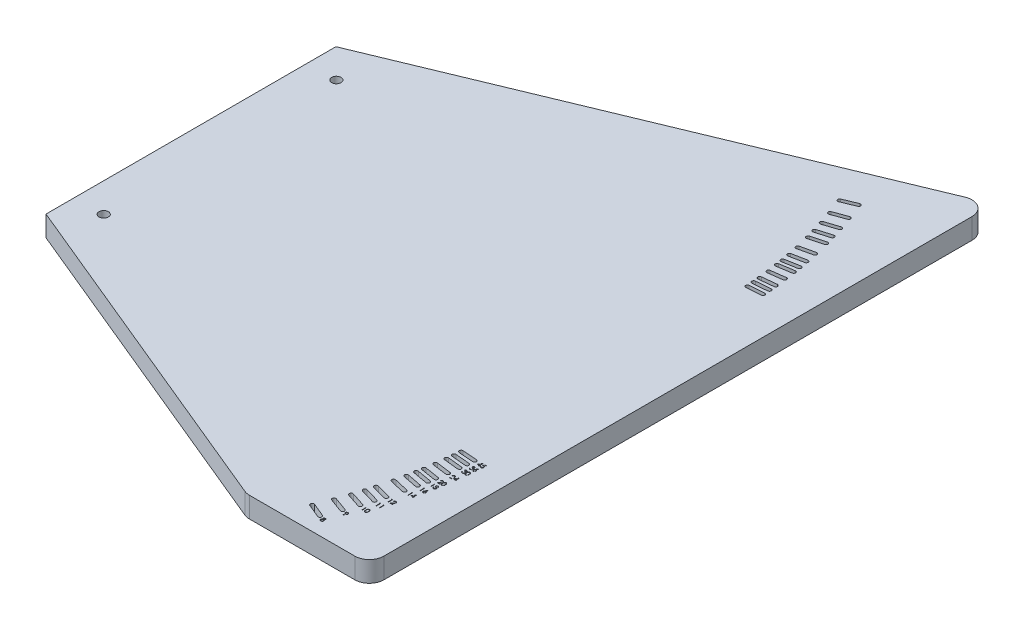
from build123d import *

# Parameters (mm, degrees)
SKETCH1_R           = 4.064
BOSS_EXTRUDE1_DEPTH = 17.9832
SKETCH2_W           = 107.311792847
SKETCH2_H           = 44.45
CUT_EXTRUDE1_DEPTH  = 17.9832
FILLET1_R           = 12.7
MAGIC_CUT_DEPTH     = 499.810781186
CUT_EXTRUDE2_DEPTH  = 1.27


with BuildPart() as part:
    # Sketch1 → Boss-Extrude1 (new body)
    with BuildSketch(Plane(origin=(0, 0, 0), x_dir=(1, 0, 0), z_dir=(0, 1, 0))):
        Polygon((0, 126.636121048), (0, -126.636121048), (406.4, -294.972512796), (406.4, 294.972512796), align=None)
        with Locations(Location((25.4, 101.6, 0), (0, 0, 270))):
            Circle(SKETCH1_R, mode=Mode.SUBTRACT)
        with Locations(Location((25.4, -101.6, 0), (0, 0, 270))):
            Circle(SKETCH1_R, mode=Mode.SUBTRACT)
    extrude(amount=BOSS_EXTRUDE1_DEPTH)

    # Sketch2 → Cut-Extrude1 (cut)
    with BuildSketch(Plane(origin=(0, 17.9832, 0), x_dir=(1, 0, 0), z_dir=(0, 1, 0))):
        with Locations((352.744103577, -272.747512796)):
            Rectangle(SKETCH2_W, SKETCH2_H)
    extrude(amount=-CUT_EXTRUDE1_DEPTH, mode=Mode.SUBTRACT)

    # Fillet1
    fillet1_edges = [part.edges().sort_by_distance(p)[0] for p in [
        (406.4, 8.9916, 250.522512796),
        (299.088207153, 8.9916, 250.522512796),
        (406.4, 8.9916, -294.972512796),
    ]]
    fillet(fillet1_edges, radius=FILLET1_R)

    # Sketch3 → Magic Cut (cut, through all)
    with BuildSketch(Plane(origin=(0, 17.9832, 0), x_dir=(1, 0, 0), z_dir=(0, 1, 0))):
        with BuildLine():
            Line((347.457416781, -236.718847511), (335.724146718, -231.85876792))
            ThreePointArc((335.724146718, -231.85876792), (334.864997909, -229.784599214), (336.939166616, -228.925450405))
            Line((336.939166616, -228.925450405), (348.672436678, -233.785529996))
            ThreePointArc((348.672436678, -233.785529996), (349.531585487, -235.859698702), (347.457416781, -236.718847511))
        make_face()
        with BuildLine():
            Line((353.044690832, -222.542297092), (341.110594548, -218.198641272))
            ThreePointArc((341.110594548, -218.198641272), (340.16178949, -216.163922259), (342.196508503, -215.215117201))
            Line((342.196508503, -215.215117201), (354.130604787, -219.558773021))
            ThreePointArc((354.130604787, -219.558773021), (355.079409845, -221.593492034), (353.044690832, -222.542297092))
        make_face()
        with BuildLine():
            Line((357.065923838, -211.033987505), (344.987506081, -207.109471677))
            ThreePointArc((344.987506081, -207.109471677), (343.96826834, -205.109104978), (345.968635038, -204.089867237))
            Line((345.968635038, -204.089867237), (358.047052795, -208.014383066))
            ThreePointArc((358.047052795, -208.014383066), (359.066290536, -210.014749764), (357.065923838, -211.033987505))
        make_face()
        with BuildLine():
            Line((362.338719597, -193.525958751), (350.071461603, -190.238956878))
            ThreePointArc((350.071461603, -190.238956878), (348.948929588, -188.294674395), (350.893212072, -187.17214238))
            Line((350.893212072, -187.17214238), (363.160470066, -190.459144253))
            ThreePointArc((363.160470066, -190.459144253), (364.283002081, -192.403426736), (362.338719597, -193.525958751))
        make_face()
        with BuildLine():
            Line((367.629553295, -171.292291597), (355.173580234, -168.814644507))
            ThreePointArc((355.173580234, -168.814644507), (353.926289487, -166.947941988), (355.792992006, -165.700651242))
            Line((355.792992006, -165.700651242), (368.248965067, -168.178298331))
            ThreePointArc((368.248965067, -168.178298331), (369.496255813, -170.04500085), (367.629553295, -171.292291597))
        make_face()
        with BuildLine():
            Line((369.068441257, -163.810008358), (356.561382794, -161.604676502))
            ThreePointArc((356.561382794, -161.604676502), (355.273666968, -159.765627712), (357.112715758, -158.477911886))
            Line((357.112715758, -158.477911886), (369.619774222, -160.683243742))
            ThreePointArc((369.619774222, -160.683243742), (370.907490047, -162.522292532), (369.068441257, -163.810008358))
        make_face()
        with BuildLine():
            Line((370.10181324, -157.802692156), (357.558171314, -155.81597445))
            ThreePointArc((357.558171314, -155.81597445), (356.238555787, -153.999679496), (358.054850741, -152.680063969))
            Line((358.054850741, -152.680063969), (370.598492666, -154.666781675))
            ThreePointArc((370.598492666, -154.666781675), (371.918108194, -156.483076629), (370.10181324, -157.802692156))
        make_face()
        with BuildLine():
            Line((360.055671235, -201.518288449), (347.870110447, -197.940285054))
            ThreePointArc((347.870110447, -197.940285054), (346.794165773, -195.969839531), (348.764611296, -194.893894857))
            Line((348.764611296, -194.893894857), (360.950172084, -198.471898252))
            ThreePointArc((360.950172084, -198.471898252), (362.026116758, -200.442343774), (360.055671235, -201.518288449))
        make_face()
        with BuildLine():
            Line((372.570833022, -139.685369305), (359.940404951, -138.357857822))
            ThreePointArc((359.940404951, -138.357857822), (358.527540377, -136.613115377), (360.272282822, -135.200250804))
            Line((360.272282822, -135.200250804), (372.902710893, -136.527762287))
            ThreePointArc((372.902710893, -136.527762287), (374.315575466, -138.272504732), (372.570833022, -139.685369305))
        make_face()
        with BuildLine():
            Line((373.182638567, -133.620602238), (360.530965901, -132.513724305))
            ThreePointArc((360.530965901, -132.513724305), (359.08786656, -130.79390548), (360.807685384, -129.350806139))
            Line((360.807685384, -129.350806139), (373.45935805, -130.457684071))
            ThreePointArc((373.45935805, -130.457684071), (374.902457392, -132.177502896), (373.182638567, -133.620602238))
        make_face()
        with BuildLine():
            Line((373.688506151, -127.546081385), (361.019442713, -126.660174168))
            ThreePointArc((361.019442713, -126.660174168), (359.546548185, -124.965802837), (361.240919517, -123.492908309))
            Line((361.240919517, -123.492908309), (373.909982955, -124.378815525))
            ThreePointArc((373.909982955, -124.378815525), (375.382877483, -126.073186857), (373.688506151, -127.546081385))
        make_face()
        with BuildLine():
            Line((371.454907505, -148.76019135), (358.863557765, -147.102508709))
            ThreePointArc((358.863557765, -147.102508709), (357.496849378, -145.321379662), (359.277978426, -143.954671274))
            Line((359.277978426, -143.954671274), (371.869328165, -145.612353915))
            ThreePointArc((371.869328165, -145.612353915), (373.236036552, -147.393482963), (371.454907505, -148.76019135))
        make_face()
        with BuildLine():
            Line((365.540325299, -180.863117283), (353.158740674, -178.037102039))
            ThreePointArc((353.158740674, -178.037102039), (351.964294501, -176.136152056), (353.865244485, -174.941705883))
            Line((353.865244485, -174.941705883), (366.24682911, -177.767721127))
            ThreePointArc((366.24682911, -177.767721127), (367.441275283, -179.66867111), (365.540325299, -180.863117283))
        make_face()
    magic_cut = extrude(amount=-MAGIC_CUT_DEPTH, mode=Mode.SUBTRACT)

    # Mirror1: Magic Cut across plane
    add(magic_cut.mirror(Plane.XY), mode=Mode.SUBTRACT)

    # Sketch5 → Cut-Extrude2 (cut)
    # profile 1 of 24: a face of its own
    with BuildSketch(Plane(origin=(0, 17.9832, 0), x_dir=(1, 0, 0), z_dir=(0, 1, 0))):
        with BuildLine():
            add(Edge.make_bspline(
                [(352.737193786, -236.613701518), (352.768379776, -236.62996255), (352.829202871, -236.661676993), (352.915828347, -236.71274278), (352.994994705, -236.766562801), (353.068898431, -236.82059498), (353.136241107, -236.876908578), (353.196269739, -236.935727528), (353.25046712, -236.995583657), (353.297740276, -237.05749054), (353.339320261, -237.121283709), (353.375256328, -237.187130604), (353.405972769, -237.254886918), (353.430316425, -237.325292267), (353.450369861, -237.397312438), (353.464168163, -237.471877384), (353.471588865, -237.548495767), (353.47299183, -237.600277261), (353.473702199, -237.626495989)],
                knots=[0, 0, 0, 0, 1.272397273, 2.481599622, 3.635517121, 4.734568067, 5.792894095, 6.808321871, 7.773003508, 8.711915296, 9.623354172, 10.525449501, 11.423591555, 12.311487226, 13.218079475, 14.126165749, 15.051214107, 16, 16, 16, 16], degree=3))
            add(Edge.make_bspline(
                [(353.473702199, -237.626495989), (353.472862453, -237.663178378), (353.47120028, -237.735786589), (353.456722297, -237.842952214), (353.435045598, -237.947032468), (353.403390472, -238.048004533), (353.362336752, -238.145311251), (353.311743396, -238.239035916), (353.254472341, -238.33071465), (353.208477761, -238.38712377), (353.185204603, -238.415666662)],
                knots=[0, 0, 0, 0, 1.025265484, 2.029385089, 3.018602448, 3.995076438, 4.983346944, 5.966715145, 6.97116228, 8, 8, 8, 8], degree=3))
            add(Edge.make_bspline(
                [(353.185204603, -238.415666662), (353.154902613, -238.448970171), (353.094673082, -238.515165647), (352.991495095, -238.601109243), (352.878259844, -238.673335298), (352.755405488, -238.732196417), (352.623260426, -238.778009881), (352.481852815, -238.810931022), (352.33090698, -238.829787723), (352.227160167, -238.832513495), (352.173936574, -238.833911854)],
                knots=[0, 0, 0, 0, 0.954267603, 1.896743057, 2.838368354, 3.796610408, 4.779680527, 5.799409237, 6.871065594, 8, 8, 8, 8], degree=3))
            add(Edge.make_bspline(
                [(352.173936574, -238.833911854), (352.122759143, -238.8326573), (352.023173059, -238.830216064), (351.878221198, -238.81367584), (351.743104371, -238.784689505), (351.617036948, -238.745016945), (351.500778942, -238.693407525), (351.394661623, -238.629172657), (351.297153956, -238.554897858), (351.211215081, -238.468449962), (351.134918803, -238.375858392), (351.06789758, -238.280334497), (351.01219094, -238.181869556), (350.965026302, -238.081931768), (350.92892054, -237.979120383), (350.903913648, -237.873964369), (350.888032138, -237.766647399), (350.885919074, -237.694222942), (350.884856046, -237.657788056)],
                knots=[0, 0, 0, 0, 1.256902934, 2.445805442, 3.576955095, 4.645999104, 5.686449165, 6.692658513, 7.68621702, 8.689161843, 9.678783111, 10.630372946, 11.551080876, 12.453998257, 13.34127905, 14.221779781, 15.105423033, 16, 16, 16, 16], degree=3))
            add(Edge.make_bspline(
                [(350.884856046, -237.657788056), (350.88548511, -237.631053622), (350.886728364, -237.578216942), (350.895333356, -237.500156216), (350.909167424, -237.424178138), (350.927955576, -237.350002071), (350.953418379, -237.278168035), (350.984161958, -237.208335662), (351.020010741, -237.140426114), (351.061464809, -237.074068018), (351.109690726, -237.010191178), (351.164297442, -236.947711538), (351.226376351, -236.887598591), (351.295236831, -236.829117894), (351.370091944, -236.771232048), (351.452885999, -236.717069384), (351.541424159, -236.662795428), (351.604349472, -236.630346936), (351.636628882, -236.613701518)],
                knots=[0, 0, 0, 0, 0.941657376, 1.861047343, 2.762797495, 3.66048619, 4.553285746, 5.444104102, 6.34607688, 7.256116206, 8.197091036, 9.162375105, 10.176350973, 11.237807142, 12.343728897, 13.50695164, 14.721116704, 16, 16, 16, 16], degree=3))
            add(Edge.make_bspline(
                [(351.636628882, -236.613701518), (351.592442271, -236.589606241), (351.506884625, -236.542951041), (351.393597605, -236.457229518), (351.296289526, -236.36438764), (351.217635105, -236.26246492), (351.155725623, -236.154645323), (351.113251085, -236.041603436), (351.084516626, -235.925435324), (351.0816702, -235.846071722), (351.080240661, -235.806213537)],
                knots=[0, 0, 0, 0, 1.166880483, 2.259407225, 3.286803203, 4.280235371, 5.237608625, 6.161067461, 7.076446754, 8, 8, 8, 8], degree=3))
            add(Edge.make_bspline(
                [(351.080240661, -235.806213537), (351.082020937, -235.765612481), (351.085599602, -235.683997277), (351.114537445, -235.562506039), (351.161694432, -235.443180579), (351.225834146, -235.326599246), (351.305721373, -235.216707726), (351.401566327, -235.118147439), (351.511080201, -235.031811225), (351.633716337, -234.959338306), (351.765690639, -234.900355523), (351.904936041, -234.85966644), (352.049026424, -234.833065981), (352.147104227, -234.83005428), (352.196833209, -234.828527239)],
                knots=[0, 0, 0, 0, 0.888701115, 1.786444228, 2.72001202, 3.692817113, 4.693886446, 5.687152267, 6.695133018, 7.739871481, 8.800368666, 9.853104506, 10.91144658, 12, 12, 12, 12], degree=3))
            add(Edge.make_bspline(
                [(352.196833209, -234.828527239), (352.245278791, -234.830101687), (352.340807958, -234.833206318), (352.481227824, -234.859100034), (352.615584619, -234.902348454), (352.743415017, -234.961019432), (352.862430564, -235.033286359), (352.967589078, -235.120808453), (353.060479688, -235.21893397), (353.137315843, -235.328792166), (353.200630303, -235.444925532), (353.244718427, -235.566434619), (353.272969004, -235.690694023), (353.276532295, -235.774773107), (353.278317584, -235.816898633)],
                knots=[0, 0, 0, 0, 1.072916533, 2.115669174, 3.151510826, 4.193348718, 5.225979165, 6.227137561, 7.216255879, 8.211077061, 9.189680878, 10.138522389, 11.067357538, 12, 12, 12, 12], degree=3))
            add(Edge.make_bspline(
                [(353.278317584, -235.816898633), (353.276755962, -235.858238944), (353.273689026, -235.939428966), (353.247889949, -236.05778555), (353.204441456, -236.168626112), (353.145120667, -236.273208383), (353.067804351, -236.36963567), (352.973524559, -236.45913417), (352.86303295, -236.542439089), (352.780017528, -236.589450531), (352.737193786, -236.613701518)],
                knots=[0, 0, 0, 0, 0.975232327, 1.915300861, 2.843280834, 3.77672583, 4.742871857, 5.749627742, 6.839139064, 8, 8, 8, 8], degree=3))
        make_face()
        with BuildLine():
            add(Edge.make_bspline(
                [(352.17775268, -235.21929647), (352.151027374, -235.220005609), (352.098740991, -235.221392996), (352.022074351, -235.228641398), (351.949170146, -235.2427419), (351.87926666, -235.261507469), (351.813322296, -235.286858107), (351.750441452, -235.316679532), (351.691694311, -235.352935563), (351.636371693, -235.393605896), (351.586568707, -235.438338459), (351.542367752, -235.48494425), (351.505652291, -235.534338606), (351.474474397, -235.585292849), (351.451852231, -235.639319276), (351.434909375, -235.694761499), (351.423456088, -235.752320132), (351.42259787, -235.791657305), (351.422163738, -235.811556085)],
                knots=[0, 0, 0, 0, 1.203892937, 2.355340988, 3.463153438, 4.544400666, 5.610487187, 6.640501085, 7.674077295, 8.714426146, 9.728707835, 10.68524104, 11.601827946, 12.495867327, 13.368432065, 14.231010473, 15.105153427, 16, 16, 16, 16], degree=3))
            add(Edge.make_bspline(
                [(351.422163738, -235.811556085), (351.422911986, -235.831455725), (351.424390631, -235.870780274), (351.435826214, -235.928851059), (351.452869818, -235.985915755), (351.479703824, -236.040617461), (351.511888917, -236.094853746), (351.551612495, -236.147269099), (351.598953409, -236.198045932), (351.652323279, -236.246752364), (351.710465553, -236.29236216), (351.772061326, -236.331956966), (351.836337541, -236.365086669), (351.902633793, -236.392659536), (351.97162576, -236.414093439), (352.042890693, -236.429299308), (352.116440568, -236.438750282), (352.166276, -236.439879154), (352.191490661, -236.440450316)],
                knots=[0, 0, 0, 0, 0.873023192, 1.725219244, 2.590779336, 3.480155217, 4.391973325, 5.357036234, 6.360879153, 7.436073238, 8.526419356, 9.601555421, 10.645666583, 11.697338044, 12.750135903, 13.812665442, 14.89329948, 16, 16, 16, 16], degree=3))
            add(Edge.make_bspline(
                [(352.191490661, -236.440450316), (352.223875774, -236.439500138), (352.288326134, -236.437609166), (352.383335921, -236.42002746), (352.475714971, -236.392371304), (352.564475893, -236.354532597), (352.64732117, -236.307040556), (352.72116993, -236.250181185), (352.785392262, -236.185267387), (352.839320754, -236.113309729), (352.881132616, -236.036727), (352.913682869, -235.959873538), (352.93269065, -235.881929396), (352.935169944, -235.829713929), (352.936394507, -235.803923874)],
                knots=[0, 0, 0, 0, 1.076279235, 2.141928126, 3.20205304, 4.278698113, 5.344010996, 6.36967002, 7.368914609, 8.37248503, 9.349703398, 10.264243087, 11.142681841, 12, 12, 12, 12], degree=3))
            add(Edge.make_bspline(
                [(352.936394507, -235.803923874), (352.935815499, -235.785823069), (352.93466625, -235.749895566), (352.925195617, -235.696840374), (352.909546496, -235.64499217), (352.888359543, -235.593922635), (352.860481453, -235.544348295), (352.827427866, -235.495489848), (352.787276451, -235.448446402), (352.742213477, -235.402121648), (352.691110046, -235.359249325), (352.634064644, -235.321546969), (352.571369733, -235.289529518), (352.503023831, -235.263524902), (352.429278642, -235.243993373), (352.350473827, -235.229366949), (352.265952301, -235.221123076), (352.2077902, -235.219918544), (352.17775268, -235.21929647)],
                knots=[0, 0, 0, 0, 0.814439003, 1.616544685, 2.417341072, 3.248991801, 4.09997495, 4.973547432, 5.9003056, 6.880240646, 7.880314356, 8.896779544, 9.951930927, 11.043077905, 12.18215768, 13.381699519, 14.647792085, 16, 16, 16, 16], degree=3))
        make_face(mode=Mode.SUBTRACT)
        with BuildLine():
            add(Edge.make_bspline(
                [(352.199886094, -236.831219547), (352.166003453, -236.831822225), (352.099533979, -236.833004532), (352.002153723, -236.846164817), (351.90869642, -236.864484814), (351.819477175, -236.892276955), (351.734533664, -236.928413706), (351.653406046, -236.971885305), (351.57671496, -237.023271802), (351.50551942, -237.081920346), (351.44050631, -237.145122209), (351.383467018, -237.212028133), (351.335028289, -237.281394662), (351.296021236, -237.354102774), (351.264004464, -237.428612887), (351.242979929, -237.506780584), (351.229501552, -237.587103127), (351.227691659, -237.641705977), (351.226779123, -237.669236374)],
                knots=[0, 0, 0, 0, 1.140299081, 2.23698856, 3.303958914, 4.344563908, 5.37730929, 6.408454204, 7.439741482, 8.480804886, 9.510774543, 10.48932336, 11.43758569, 12.353841022, 13.263987381, 14.161954604, 15.073269652, 16, 16, 16, 16], degree=3))
            add(Edge.make_bspline(
                [(351.226779123, -237.669236374), (351.228263127, -237.70345116), (351.231207357, -237.771332497), (351.254564441, -237.871658583), (351.292049982, -237.968782074), (351.344328859, -238.061911485), (351.40906356, -238.148942887), (351.488666944, -238.224804097), (351.57819197, -238.292210049), (351.680667748, -238.346726287), (351.792603878, -238.390263544), (351.913970589, -238.420260177), (352.043026086, -238.440117298), (352.132136099, -238.44211829), (352.17775268, -238.443142624)],
                knots=[0, 0, 0, 0, 0.898778495, 1.783155532, 2.693654817, 3.627872908, 4.583023416, 5.533784346, 6.509005473, 7.520592997, 8.575161974, 9.658835044, 10.801527049, 12, 12, 12, 12], degree=3))
            add(Edge.make_bspline(
                [(352.17775268, -238.443142624), (352.213403795, -238.442458121), (352.282863599, -238.44112449), (352.384194303, -238.429352358), (352.479819369, -238.410683766), (352.569553358, -238.383530935), (352.654400795, -238.350383961), (352.732923104, -238.307742352), (352.8071403, -238.259243966), (352.873395245, -238.201704087), (352.933738253, -238.140222123), (352.986352494, -238.07513639), (353.032026285, -238.008215773), (353.067873983, -237.93794796), (353.096531991, -237.865681061), (353.117131631, -237.79074869), (353.129842026, -237.712921023), (353.131127515, -237.66012632), (353.131779123, -237.633364979)],
                knots=[0, 0, 0, 0, 1.224942928, 2.386581632, 3.501229538, 4.569074225, 5.605009692, 6.626002462, 7.634866581, 8.645888296, 9.63523824, 10.59253846, 11.518950513, 12.414518923, 13.29783783, 14.186679152, 15.080837789, 16, 16, 16, 16], degree=3))
            add(Edge.make_bspline(
                [(353.131779123, -237.633364979), (353.130793042, -237.607372789), (353.128848663, -237.556120729), (353.116507864, -237.480174881), (353.094828009, -237.406802103), (353.065080186, -237.335119668), (353.025476909, -237.266579999), (352.978837208, -237.199397538), (352.922564468, -237.135436952), (352.858978184, -237.074201439), (352.789680859, -237.017578594), (352.716020338, -236.967488591), (352.638563624, -236.925304144), (352.55747462, -236.890996188), (352.47293338, -236.864013256), (352.385002087, -236.845163559), (352.29357779, -236.833298563), (352.231469488, -236.831920381), (352.199886094, -236.831219547)],
                knots=[0, 0, 0, 0, 0.917430815, 1.809013306, 2.70690318, 3.612392954, 4.541220862, 5.495268465, 6.494511384, 7.542276156, 8.608045339, 9.649016899, 10.681629292, 11.715607085, 12.752076957, 13.808767841, 14.885711793, 16, 16, 16, 16], degree=3))
        make_face(mode=Mode.SUBTRACT)
    # profile 2 of 24: a face of its own
    with BuildSketch(Plane(origin=(0, 17.9832, 0), x_dir=(1, 0, 0), z_dir=(0, 1, 0))):
        with BuildLine():
            Line((357.387388554, -224.512330461), (357.114155381, -224.322288393))
            Line((357.114155381, -224.322288393), (358.173506342, -222.773712672))
            add(Edge.make_bspline(
                [(358.173506342, -222.773712672), (358.105916142, -222.781978264), (357.972827268, -222.798253675), (357.838783737, -222.801243605), (357.772815237, -222.802715076)],
                knots=[0, 0, 0, 0, 1.015715272, 2, 2, 2, 2], degree=3))
            add(Edge.make_bspline(
                [(357.772815237, -222.802715076), (357.732818893, -222.801690647), (357.654309569, -222.799679783), (357.538886541, -222.783741129), (357.427976831, -222.759193704), (357.321874475, -222.72256463), (357.220180671, -222.677042523), (357.123117423, -222.620592459), (357.030815394, -222.554182753), (356.944265899, -222.478164554), (356.865549406, -222.394695017), (356.795420045, -222.306351303), (356.737136698, -222.212107175), (356.688720758, -222.113885136), (356.65200275, -222.010273437), (356.625264673, -221.90245109), (356.60880291, -221.789662417), (356.606844466, -221.712890774), (356.605850092, -221.67391099)],
                knots=[0, 0, 0, 0, 1.060718605, 2.082097864, 3.085795603, 4.069760067, 5.054557537, 6.03741023, 7.043284206, 8.066802108, 9.088538119, 10.083643548, 11.053783639, 12.022749082, 12.983451788, 13.964007469, 14.966251758, 16, 16, 16, 16], degree=3))
            add(Edge.make_bspline(
                [(356.605850092, -221.67391099), (356.607738149, -221.620605113), (356.61144402, -221.515976492), (356.641269263, -221.363104303), (356.690320661, -221.218556666), (356.758713837, -221.082713626), (356.844857633, -220.957529284), (356.948390127, -220.844743913), (357.068681585, -220.745961657), (357.202991726, -220.661048647), (357.348156015, -220.592757122), (357.500195325, -220.542422341), (357.657944696, -220.512814561), (357.764807217, -220.508911095), (357.818608506, -220.506945845)],
                knots=[0, 0, 0, 0, 1.022988612, 2.007919123, 2.978103895, 3.94594894, 4.918897164, 5.887013414, 6.875921846, 7.89917871, 8.930658928, 9.948724884, 10.967259574, 12, 12, 12, 12], degree=3))
            add(Edge.make_bspline(
                [(357.818608506, -220.506945845), (357.871391614, -220.508938109), (357.975686061, -220.512874633), (358.129053808, -220.541704325), (358.275946744, -220.590294532), (358.415550572, -220.657442585), (358.544806903, -220.741611916), (358.661040001, -220.841906926), (358.761597373, -220.958390086), (358.846314226, -221.088244128), (358.914317327, -221.227763042), (358.963381727, -221.373396398), (358.993584837, -221.524096834), (358.997390839, -221.626198819), (358.999311631, -221.677727095)],
                knots=[0, 0, 0, 0, 1.026385292, 2.028040595, 3.023318987, 4.028184125, 5.03290303, 6.015178782, 7.004435299, 8.016004309, 9.023023918, 10.015172535, 10.998308025, 12, 12, 12, 12], degree=3))
            add(Edge.make_bspline(
                [(358.999311631, -221.677727095), (358.998028849, -221.71772531), (358.995427046, -221.798851685), (358.97720838, -221.922111001), (358.946270978, -222.047787911), (358.911162701, -222.154164848), (358.877273112, -222.24202176), (358.845376738, -222.311419909), (358.809984936, -222.384464427), (358.768707651, -222.460389386), (358.72433498, -222.54016266), (358.674196167, -222.62298413), (358.619434959, -222.708964937), (358.58043175, -222.766928196), (358.560459467, -222.796609307)],
                knots=[0, 0, 0, 0, 1.179839688, 2.393009684, 3.667231171, 4.993948276, 5.694988576, 6.444077775, 7.246288328, 8.089075292, 8.993003841, 9.939041771, 10.944649915, 12, 12, 12, 12], degree=3))
            Line((358.560459467, -222.796609307), (357.387388554, -224.512330461))
        make_face()
        with BuildLine():
            add(Edge.make_bspline(
                [(357.836162592, -222.411945845), (357.866461905, -222.411118113), (357.925444366, -222.4095068), (358.011852226, -222.399699597), (358.093412573, -222.382310772), (358.170343276, -222.357361029), (358.243415703, -222.327254769), (358.311469192, -222.288924007), (358.374560697, -222.243185899), (358.433112697, -222.191794424), (358.485107223, -222.134698218), (358.53141835, -222.074938796), (358.570781711, -222.012253835), (358.601874878, -221.945858312), (358.627439516, -221.877368437), (358.645093981, -221.805681267), (358.654874069, -221.731170294), (358.656541298, -221.680553183), (358.657388554, -221.654830461)],
                knots=[0, 0, 0, 0, 1.163407946, 2.26475976, 3.333800367, 4.359385343, 5.366239384, 6.363380779, 7.350133999, 8.353570782, 9.349036268, 10.310270964, 11.253520213, 12.184142, 13.120487599, 14.056272588, 15.012232024, 16, 16, 16, 16], degree=3))
            add(Edge.make_bspline(
                [(358.657388554, -221.654830461), (358.656659571, -221.629096997), (358.655223021, -221.578386049), (358.643697989, -221.503764761), (358.623423104, -221.432252954), (358.596219176, -221.363459126), (358.560383146, -221.297948493), (358.51738078, -221.234898575), (358.466291456, -221.174709144), (358.407505805, -221.118795779), (358.344113335, -221.067254209), (358.276556047, -221.021767081), (358.205390782, -220.983644007), (358.131051705, -220.952185414), (358.053383931, -220.927636195), (357.972433419, -220.909982436), (357.887791106, -220.90021604), (357.830334906, -220.898559349), (357.801054419, -220.897715076)],
                knots=[0, 0, 0, 0, 0.972161553, 1.915763587, 2.844109794, 3.775983486, 4.705125789, 5.659731448, 6.655561913, 7.682237399, 8.721216875, 9.739758359, 10.754845918, 11.767244016, 12.7857855, 13.828538656, 14.893392813, 16, 16, 16, 16], degree=3))
            add(Edge.make_bspline(
                [(357.801054419, -220.897715076), (357.772028584, -220.898560713), (357.715080134, -220.900219845), (357.631190291, -220.909963871), (357.550787134, -220.927754921), (357.473344399, -220.952174043), (357.399007532, -220.983646354), (357.327845623, -221.021769078), (357.260272533, -221.067243739), (357.19694084, -221.118836334), (357.138051388, -221.174448886), (357.087840455, -221.235162247), (357.044739675, -221.297915695), (357.008952886, -221.363467842), (356.98173586, -221.432250628), (356.961464481, -221.503765391), (356.949938507, -221.578385885), (356.948502087, -221.629096941), (356.947773169, -221.654830461)],
                knots=[0, 0, 0, 0, 1.099389452, 2.15699305, 3.192601482, 4.213358962, 5.227959689, 6.245255729, 7.266013209, 8.307253147, 9.336162325, 10.327954924, 11.284637477, 12.215801273, 13.149702402, 14.080068371, 15.025723358, 16, 16, 16, 16], degree=3))
            add(Edge.make_bspline(
                [(356.947773169, -221.654830461), (356.948432763, -221.680573214), (356.949733603, -221.731342636), (356.962282426, -221.805938509), (356.98326821, -221.8774448), (357.011374461, -221.946556793), (357.048387621, -222.012602444), (357.093807009, -222.075268629), (357.14704419, -222.135265734), (357.2073875, -222.191661584), (357.273429127, -222.243425524), (357.343965013, -222.288634311), (357.417780864, -222.326813172), (357.495136525, -222.357447079), (357.575458728, -222.38206149), (357.659469371, -222.399667549), (357.746890623, -222.409412731), (357.806119775, -222.411093373), (357.836162592, -222.411945845)],
                knots=[0, 0, 0, 0, 0.952633368, 1.87876736, 2.791047057, 3.707742249, 4.635551637, 5.587206343, 6.568248508, 7.601284464, 8.641511608, 9.671105535, 10.699146789, 11.713763218, 12.747829548, 13.806491675, 14.887386225, 16, 16, 16, 16], degree=3))
        make_face(mode=Mode.SUBTRACT)
    # profile 3 of 24: a face of its own
    with BuildSketch(Plane(origin=(0, 17.9832, 0), x_dir=(1, 0, 0), z_dir=(0, 1, 0))):
        Polygon((361.45130801, -208.977724145), (362.155761135, -208.977724145), (362.155761135, -212.787724145), (361.813838058, -212.787724145), (361.813838058, -209.368493376), (361.227684212, -209.368493376), align=None)
    # profile 4 of 24: a face of its own
    with BuildSketch(Plane(origin=(0, 17.9832, 0), x_dir=(1, 0, 0), z_dir=(0, 1, 0))):
        with BuildLine():
            add(Edge.make_bspline(
                [(363.572299597, -210.884250588), (363.572656668, -210.823184574), (363.573350284, -210.704562963), (363.581066536, -210.531714538), (363.593884837, -210.369560624), (363.611451521, -210.218093457), (363.632828865, -210.077273937), (363.661366294, -209.947478387), (363.69381966, -209.828106072), (363.731432465, -209.718767728), (363.773873458, -209.617990285), (363.820066182, -209.523910281), (363.871843858, -209.436670063), (363.926247298, -209.354877211), (363.985478724, -209.279870617), (364.04785255, -209.210591033), (364.115803221, -209.148639616), (364.187020839, -209.092201213), (364.26215019, -209.042726217), (364.339049778, -208.999147721), (364.418248908, -208.961918723), (364.49996381, -208.932646563), (364.583460023, -208.90846847), (364.669029429, -208.891934215), (364.756813314, -208.881530838), (364.816065819, -208.880536245), (364.846115702, -208.880031838)],
                knots=[0, 0, 0, 0, 1.646270934, 3.197905019, 4.663502075, 6.030701355, 7.308322542, 8.50163776, 9.611534131, 10.641858119, 11.616356847, 12.558055219, 13.465016945, 14.349605745, 15.204443733, 16.039544428, 16.859896111, 17.680448484, 18.487036065, 19.28249412, 20.06191084, 20.843045899, 21.620316918, 22.403196591, 23.190181807, 24, 24, 24, 24], degree=3))
            add(Edge.make_bspline(
                [(364.846115702, -208.880031838), (364.876416609, -208.880562859), (364.936675579, -208.881618894), (365.025764673, -208.891768672), (365.112795612, -208.908610094), (365.197397357, -208.932472641), (365.280264843, -208.962077078), (365.360749904, -208.999183339), (365.43935247, -209.042376621), (365.51482344, -209.093130041), (365.58799135, -209.149716462), (365.657058989, -209.213683824), (365.722032646, -209.284386233), (365.783727764, -209.361067234), (365.840394, -209.445197569), (365.894358221, -209.535313985), (365.942660352, -209.632992441), (365.989180098, -209.736603179), (366.029334218, -209.849013048), (366.065546902, -209.969588401), (366.09480658, -210.099753445), (366.119178902, -210.238825243), (366.13806006, -210.387314532), (366.151811593, -210.544903007), (366.159075723, -210.711694346), (366.160443732, -210.825730748), (366.16114575, -210.884250588)],
                knots=[0, 0, 0, 0, 0.810914788, 1.612654377, 2.396697861, 3.181598691, 3.963628158, 4.749916497, 5.551656086, 6.361998678, 7.18212741, 8.025565596, 8.878627764, 9.750805457, 10.657531673, 11.591944965, 12.560506719, 13.57287815, 14.630710178, 15.753379473, 16.941251878, 18.199788006, 19.531962791, 20.947069417, 22.433333509, 24, 24, 24, 24], degree=3))
            add(Edge.make_bspline(
                [(366.16114575, -210.884250588), (366.160436454, -210.942515185), (366.159054419, -211.056041376), (366.151893027, -211.222082237), (366.137786631, -211.378834393), (366.120140901, -211.526673782), (366.095701424, -211.664985076), (366.065651229, -211.79424689), (366.032286163, -211.915017436), (365.991100288, -212.026307331), (365.946021771, -212.129669064), (365.896975972, -212.226189588), (365.844430819, -212.316722038), (365.787184213, -212.400541763), (365.726166069, -212.478242529), (365.660070419, -212.548452799), (365.590760439, -212.612864302), (365.51737721, -212.670179359), (365.440729207, -212.720345961), (365.362396611, -212.765210181), (365.280989557, -212.801386343), (365.198352886, -212.832448773), (365.113304579, -212.856180122), (365.02595065, -212.872589091), (364.936735434, -212.884097303), (364.876426873, -212.884975214), (364.846115702, -212.885416453)],
                knots=[0, 0, 0, 0, 1.561518951, 3.042555995, 4.452378317, 5.7783523, 7.031515105, 8.214008947, 9.334062868, 10.386615937, 11.391082383, 12.354592575, 13.286541444, 14.194233754, 15.072674879, 15.931287219, 16.775624067, 17.606195743, 18.42308326, 19.229000347, 20.022332153, 20.807536673, 21.593273796, 22.3848459, 23.188221202, 24, 24, 24, 24], degree=3))
            add(Edge.make_bspline(
                [(364.846115702, -212.885416453), (364.816066653, -212.884908792), (364.756815792, -212.883907783), (364.669019866, -212.873551407), (364.583803834, -212.856901159), (364.500747191, -212.833587656), (364.419423813, -212.805050934), (364.340941855, -212.76787221), (364.264428691, -212.725054266), (364.190088454, -212.67629125), (364.119318073, -212.620423932), (364.051719306, -212.558631949), (363.988990356, -212.489373322), (363.930605812, -212.41374164), (363.875116876, -212.33243271), (363.824074444, -212.244336396), (363.776862172, -212.149802011), (363.7337074, -212.0482188), (363.695445569, -211.938104435), (363.661647921, -211.818199187), (363.63496251, -211.687444737), (363.612121064, -211.54689126), (363.593697665, -211.395934782), (363.581119956, -211.234493349), (363.573346125, -211.062667564), (363.572654805, -210.944808182), (363.572299597, -210.884250588)],
                knots=[0, 0, 0, 0, 0.810891512, 1.598919785, 2.382837074, 3.152667961, 3.926044502, 4.706494248, 5.493654104, 6.291793342, 7.103789334, 7.925228297, 8.761435821, 9.622817696, 10.50288917, 11.416980706, 12.369136599, 13.353924996, 14.394355917, 15.514179734, 16.714354668, 17.994756427, 19.357759367, 20.818452758, 22.365282078, 24, 24, 24, 24], degree=3))
        make_face()
        with BuildLine():
            add(Edge.make_bspline(
                [(363.914222674, -210.882724145), (363.9143527, -210.933613443), (363.914605056, -211.032379578), (363.921197663, -211.175900385), (363.93017863, -211.309762371), (363.941762442, -211.434135507), (363.958965081, -211.548598806), (363.978240184, -211.653939518), (364.001696819, -211.749600168), (364.029449967, -211.836237184), (364.061061098, -211.915320885), (364.095575195, -211.988909636), (364.132652725, -212.057872744), (364.174148143, -212.121590758), (364.219340255, -212.180271468), (364.267208288, -212.234953494), (364.31953873, -212.283718208), (364.391932804, -212.342203727), (364.487505538, -212.40264027), (364.607923805, -212.455268442), (364.731660033, -212.488341916), (364.815644679, -212.49254789), (364.85756402, -212.494647222)],
                knots=[0, 0, 0, 0, 1.459021318, 2.831673884, 4.118529203, 5.306027144, 6.411944654, 7.436330062, 8.375795394, 9.233974572, 10.042671642, 10.816086306, 11.563610507, 12.285937304, 12.993564865, 13.685989202, 14.367179055, 15.041617293, 16.353048772, 17.594441528, 18.799311195, 20, 20, 20, 20], degree=3))
            add(Edge.make_bspline(
                [(364.85756402, -212.494647222), (364.899754514, -212.492907924), (364.984048394, -212.489432918), (365.107202611, -212.455906292), (365.226760705, -212.405320879), (365.32045616, -212.345506595), (365.391738586, -212.28854347), (365.442811081, -212.239977239), (365.489687197, -212.185596709), (365.534146712, -212.126923476), (365.574923592, -212.062836571), (365.61200375, -211.993644168), (365.645840194, -211.91915412), (365.665117756, -211.867153347), (365.674973875, -211.840566694)],
                knots=[0, 0, 0, 0, 1.353760809, 2.704726607, 4.075137775, 5.516104923, 6.260822281, 7.007110065, 7.778089737, 8.566572457, 9.372053459, 10.217411131, 11.088608312, 12, 12, 12, 12], degree=3))
            add(Edge.make_bspline(
                [(365.674973875, -211.840566694), (365.686460228, -211.806570891), (365.709782451, -211.737544834), (365.739839839, -211.630468972), (365.76351126, -211.518125392), (365.784807381, -211.40118548), (365.799343136, -211.278786834), (365.811042898, -211.15130817), (365.817934303, -211.018653373), (365.818788561, -210.928525111), (365.819222674, -210.882724145)],
                knots=[0, 0, 0, 0, 0.884706709, 1.796334032, 2.740027952, 3.714592787, 4.726048262, 5.777819803, 6.87074269, 8, 8, 8, 8], degree=3))
            add(Edge.make_bspline(
                [(365.819222674, -210.882724145), (365.818623753, -210.836930588), (365.817452137, -210.7473486), (365.812973768, -210.616155952), (365.801409248, -210.491549618), (365.788565064, -210.372992789), (365.769626947, -210.261141745), (365.749207734, -210.155060127), (365.721774414, -210.056062149), (365.692470316, -209.962597861), (365.658931, -209.875729149), (365.622011301, -209.795050999), (365.582581329, -209.720173912), (365.53975449, -209.651303327), (365.494039189, -209.588130759), (365.444228829, -209.531922815), (365.392299212, -209.48093743), (365.319563932, -209.422739604), (365.224341919, -209.36339973), (365.105855658, -209.308790717), (364.982552471, -209.277430833), (364.899196796, -209.273009397), (364.85756402, -209.270801069)],
                knots=[0, 0, 0, 0, 1.31362396, 2.569729283, 3.763502607, 4.902122613, 5.988968491, 7.01645872, 7.998833611, 8.933434873, 9.825090667, 10.667526885, 11.477055099, 12.250526234, 12.991942729, 13.710640831, 14.402115721, 15.076753259, 16.378508321, 17.609869233, 18.806226677, 20, 20, 20, 20], degree=3))
            add(Edge.make_bspline(
                [(364.85756402, -209.270801069), (364.815424775, -209.273012443), (364.731069519, -209.277439221), (364.606484745, -209.308673877), (364.487063722, -209.363116563), (364.392093513, -209.422936146), (364.319307505, -209.479910136), (364.26805463, -209.529316533), (364.219998368, -209.583360027), (364.175728672, -209.642580398), (364.134265767, -209.706224126), (364.096186436, -209.774791896), (364.061877571, -209.848631181), (364.030216976, -209.927679358), (364.00237917, -210.0143089), (363.979416884, -210.109851719), (363.958203835, -210.214857378), (363.943186699, -210.329940614), (363.929836725, -210.454344901), (363.921257315, -210.588541067), (363.914583003, -210.732302578), (363.914345189, -210.831579377), (363.914222674, -210.882724145)],
                knots=[0, 0, 0, 0, 1.207732386, 2.417664972, 3.655092373, 4.956220595, 5.625982001, 6.301752483, 6.994047911, 7.697131622, 8.419323945, 9.170223765, 9.943494443, 10.752040957, 11.610060368, 12.549350801, 13.567764191, 14.679664412, 15.874934091, 17.154273443, 18.533957287, 20, 20, 20, 20], degree=3))
        make_face(mode=Mode.SUBTRACT)
    # profile 5 of 24: a face of its own
    with BuildSketch(Plane(origin=(0, 17.9832, 0), x_dir=(1, 0, 0), z_dir=(0, 1, 0))):
        Polygon((364.489736812, -199.363389239), (365.194189937, -199.363389239), (365.194189937, -203.173389239), (364.85226686, -203.173389239), (364.85226686, -199.754158469), (364.266113014, -199.754158469), align=None)
    # profile 6 of 24: a face of its own
    with BuildSketch(Plane(origin=(0, 17.9832, 0), x_dir=(1, 0, 0), z_dir=(0, 1, 0))):
        Polygon((367.420506043, -199.363389239), (368.124959168, -199.363389239), (368.124959168, -203.173389239), (367.783036091, -203.173389239), (367.783036091, -199.754158469), (367.196882245, -199.754158469), align=None)
    # profile 7 of 24: a face of its own
    with BuildSketch(Plane(origin=(0, 17.9832, 0), x_dir=(1, 0, 0), z_dir=(0, 1, 0))):
        Polygon((366.811187835, -191.2878284), (367.51564096, -191.2878284), (367.51564096, -195.0978284), (367.173717883, -195.0978284), (367.173717883, -191.678597631), (366.587564037, -191.678597631), align=None)
    # profile 8 of 24: a face of its own
    with BuildSketch(Plane(origin=(0, 17.9832, 0), x_dir=(1, 0, 0), z_dir=(0, 1, 0))):
        with BuildLine():
            Line((369.42064096, -192.460136093), (369.078717883, -192.460136093))
            add(Edge.make_bspline(
                [(369.078717883, -192.460136093), (369.080946356, -192.414774355), (369.085323016, -192.325685109), (369.105818954, -192.195792514), (369.135146023, -192.071635718), (369.176611291, -191.954211612), (369.228107554, -191.842481939), (369.289862241, -191.736890493), (369.363007547, -191.637840085), (369.44596402, -191.546248944), (369.536063596, -191.46222476), (369.63327949, -191.389665767), (369.735436505, -191.328359959), (369.842224708, -191.277108665), (369.954848921, -191.238638718), (370.072287118, -191.21009459), (370.195055264, -191.192920911), (370.278701116, -191.191074927), (370.321241922, -191.190136093)],
                knots=[0, 0, 0, 0, 1.10065271, 2.161652631, 3.183658789, 4.190468796, 5.17591951, 6.163126047, 7.15150782, 8.156236427, 9.156009102, 10.134482811, 11.092018607, 12.041330605, 13.001268258, 13.972401359, 14.968799086, 16, 16, 16, 16], degree=3))
            add(Edge.make_bspline(
                [(370.321241922, -191.190136093), (370.363019197, -191.191114127), (370.44511005, -191.193035928), (370.564920414, -191.209539792), (370.678977983, -191.235388564), (370.787059809, -191.271654775), (370.888303554, -191.320405823), (370.983469782, -191.378968286), (371.073691465, -191.446699017), (371.154906278, -191.526441025), (371.229482215, -191.611569907), (371.293819242, -191.702452453), (371.348915285, -191.79631919), (371.394839588, -191.893885889), (371.428646414, -191.996071209), (371.454312977, -192.10138745), (371.468820819, -192.210924744), (371.471047409, -192.285063595), (371.472179422, -192.322756285)],
                knots=[0, 0, 0, 0, 1.111607364, 2.184268762, 3.212621178, 4.221274766, 5.211760367, 6.196651075, 7.1921475, 8.207485113, 9.220403448, 10.201281604, 11.166441695, 12.114753415, 13.065576456, 14.026450734, 14.996634279, 16, 16, 16, 16], degree=3))
            add(Edge.make_bspline(
                [(371.472179422, -192.322756285), (371.470336184, -192.375821785), (371.466682055, -192.48102156), (371.435424406, -192.635614882), (371.386605775, -192.785395147), (371.327825795, -192.90594061), (371.268528649, -193.003077642), (371.21509339, -193.083053575), (371.152538839, -193.169165528), (371.079954531, -193.261125144), (370.998841948, -193.359652729), (370.908466393, -193.464688763), (370.808183402, -193.575148033), (370.737798006, -193.65059213), (370.701326057, -193.689685371)],
                knots=[0, 0, 0, 0, 1.184426356, 2.348067706, 3.509069118, 4.696110526, 5.333549288, 6.050745305, 6.844228056, 7.710549037, 8.667450064, 9.695053472, 10.805634456, 12, 12, 12, 12], degree=3))
            Line((370.701326057, -193.689685371), (369.748062835, -194.707059169))
            Line((369.748062835, -194.707059169), (371.521025576, -194.707059169))
            Line((371.521025576, -194.707059169), (371.521025576, -195.0978284))
            Line((371.521025576, -195.0978284), (368.932179422, -195.0978284))
            Line((368.932179422, -195.0978284), (370.409775576, -193.521013496))
            add(Edge.make_bspline(
                [(370.409775576, -193.521013496), (370.445750561, -193.483459626), (370.514851146, -193.411326325), (370.612585893, -193.306014703), (370.700367192, -193.208315917), (370.778763268, -193.11841456), (370.846073456, -193.034995625), (370.905805799, -192.960760819), (370.953665486, -192.892448117), (371.005607102, -192.813264763), (371.055914322, -192.716586212), (371.099144058, -192.598439539), (371.12550365, -192.476816444), (371.128665771, -192.394627084), (371.130256345, -192.353285131)],
                knots=[0, 0, 0, 0, 1.329631726, 2.553950428, 3.673215718, 4.687767853, 5.603093632, 6.413772471, 7.123043292, 7.734684054, 8.834405432, 9.900288307, 10.943827018, 12, 12, 12, 12], degree=3))
            add(Edge.make_bspline(
                [(371.130256345, -192.353285131), (371.129564294, -192.327288523), (371.128200395, -192.276054201), (371.116163301, -192.200936503), (371.097972722, -192.128475949), (371.071906598, -192.058449652), (371.037500404, -191.991561671), (370.995619382, -191.927730585), (370.947297627, -191.866020597), (370.891398102, -191.808159436), (370.829990133, -191.755166466), (370.765117536, -191.708222819), (370.696482994, -191.668991673), (370.62437589, -191.636831466), (370.54899725, -191.611603408), (370.470201285, -191.594122497), (370.388205713, -191.583146993), (370.332216679, -191.581661995), (370.303687835, -191.580905323)],
                knots=[0, 0, 0, 0, 0.991446411, 1.95395049, 2.89581595, 3.838931463, 4.798493298, 5.75982156, 6.748411868, 7.785213223, 8.824556874, 9.840280684, 10.836137867, 11.835679398, 12.848801643, 13.863922112, 14.911575587, 16, 16, 16, 16], degree=3))
            add(Edge.make_bspline(
                [(370.303687835, -191.580905323), (370.273892729, -191.581683687), (370.215380059, -191.583212265), (370.129471055, -191.593904936), (370.047517108, -191.612351694), (369.969312066, -191.637581159), (369.894723602, -191.669648894), (369.824114457, -191.709590479), (369.75764314, -191.757251939), (369.695184696, -191.81128923), (369.637638479, -191.871451961), (369.587077737, -191.938518807), (369.542899139, -192.011265222), (369.504353659, -192.089494919), (369.473051036, -192.173917748), (369.449131693, -192.264234021), (369.430204868, -192.360051582), (369.423881879, -192.426220488), (369.42064096, -192.460136093)],
                knots=[0, 0, 0, 0, 1.031018746, 2.02475058, 2.990194455, 3.934040569, 4.864654155, 5.795059489, 6.735614925, 7.690564532, 8.649604399, 9.611025574, 10.590972636, 11.591080095, 12.624614302, 13.701020113, 14.821632451, 16, 16, 16, 16], degree=3))
        make_face()
    # profile 9 of 24: a face of its own
    with BuildSketch(Plane(origin=(0, 17.9832, 0), x_dir=(1, 0, 0), z_dir=(0, 1, 0))):
        Polygon((370.335850234, -177.347801008), (371.040303359, -177.347801008), (371.040303359, -181.157801008), (370.698380282, -181.157801008), (370.698380282, -177.738570239), (370.112226435, -177.738570239), align=None)
    # profile 10 of 24: a face of its own
    with BuildSketch(Plane(origin=(0, 17.9832, 0), x_dir=(1, 0, 0), z_dir=(0, 1, 0))):
        Polygon((374.536619464, -177.250108701), (374.606072589, -177.250108701), (374.606072589, -179.887801008), (375.045687974, -179.887801008), (375.045687974, -180.278570239), (374.606072589, -180.278570239), (374.606072589, -181.157801008), (374.264149512, -181.157801008), (374.264149512, -180.278570239), (372.45684182, -180.278570239), align=None)
        Polygon((374.264149512, -179.887801008), (374.264149512, -178.233137547), (373.128476435, -179.887801008), align=None, mode=Mode.SUBTRACT)
    # profile 11 of 24: a face of its own
    with BuildSketch(Plane(origin=(0, 17.9832, 0), x_dir=(1, 0, 0), z_dir=(0, 1, 0))):
        Polygon((372.197298375, -168.8208284), (372.9017515, -168.8208284), (372.9017515, -172.6308284), (372.559828423, -172.6308284), (372.559828423, -169.211597631), (371.973674577, -169.211597631), align=None)
    # profile 12 of 24: a face of its own
    with BuildSketch(Plane(origin=(0, 17.9832, 0), x_dir=(1, 0, 0), z_dir=(0, 1, 0))):
        with BuildLine():
            Line((376.0767515, -168.723136092), (376.340062798, -168.929969025))
            Line((376.340062798, -168.929969025), (375.333374096, -170.469386092))
            add(Edge.make_bspline(
                [(375.333374096, -170.469386092), (375.40039774, -170.458703004), (375.531134937, -170.437864432), (375.663468101, -170.434426783), (375.727959433, -170.432751477)],
                knots=[0, 0, 0, 0, 1.025318673, 2, 2, 2, 2], degree=3))
            add(Edge.make_bspline(
                [(375.727959433, -170.432751477), (375.766682636, -170.433792273), (375.842908109, -170.435841048), (375.954820656, -170.451607754), (376.062359469, -170.476454519), (376.165078824, -170.512673746), (376.263347413, -170.558940595), (376.357729164, -170.614391194), (376.446449924, -170.681888806), (376.530652208, -170.757288658), (376.607099419, -170.840800575), (376.674782497, -170.929411744), (376.73163509, -171.023029846), (376.777762131, -171.121607463), (376.813581441, -171.22499264), (376.839693706, -171.3330531), (376.855129206, -171.445863359), (376.85722524, -171.522583887), (376.858289961, -171.561555563)],
                knots=[0, 0, 0, 0, 1.04369286, 2.054478336, 3.041073146, 4.015093852, 4.984733326, 5.965804835, 6.960378782, 7.985147595, 9.009457201, 10.008161701, 10.986880575, 11.956520048, 12.937015923, 13.931873656, 14.949455224, 16, 16, 16, 16], degree=3))
            add(Edge.make_bspline(
                [(376.858289961, -171.561555563), (376.85674081, -171.61487347), (376.853692447, -171.719790491), (376.823317172, -171.872600563), (376.776117101, -172.018177958), (376.708650135, -172.154198411), (376.624849312, -172.280475494), (376.522656847, -172.392364814), (376.405696935, -172.492154198), (376.273449878, -172.575600403), (376.131126823, -172.643748296), (375.981609363, -172.692696174), (375.826349526, -172.722831608), (375.720970796, -172.726609607), (375.667664961, -172.728520708)],
                knots=[0, 0, 0, 0, 1.031375318, 2.029502543, 3.004789286, 3.987476834, 4.960371455, 5.9300674, 6.912260825, 7.929083631, 8.949397511, 9.960523116, 10.96833055, 12, 12, 12, 12], degree=3))
            add(Edge.make_bspline(
                [(375.667664961, -172.728520708), (375.616396839, -172.726857146), (375.514843664, -172.723561923), (375.365455965, -172.694207574), (375.221913652, -172.64662927), (375.085222412, -172.581081727), (374.958599116, -172.498287289), (374.845316237, -172.398615208), (374.74593862, -172.284196047), (374.663234818, -172.155047555), (374.597638884, -172.01626563), (374.548446423, -171.87155404), (374.519712227, -171.721440059), (374.515696969, -171.619679162), (374.513674577, -171.568424554)],
                knots=[0, 0, 0, 0, 1.012016664, 2.004627821, 2.994792927, 3.992885782, 4.990978636, 5.973936114, 6.964471063, 7.975201453, 8.993600317, 9.990122807, 10.98767138, 12, 12, 12, 12], degree=3))
            add(Edge.make_bspline(
                [(374.513674577, -171.568424554), (374.514960664, -171.52918745), (374.517586609, -171.449072782), (374.535921842, -171.327736226), (374.565383804, -171.203583477), (374.598378673, -171.098259626), (374.633240837, -171.011977798), (374.66225403, -170.942414284), (374.698366294, -170.870828658), (374.736872746, -170.794766215), (374.781239509, -170.716187215), (374.829480259, -170.633778363), (374.882928736, -170.548850276), (374.920397542, -170.491216738), (374.939551981, -170.461753881)],
                knots=[0, 0, 0, 0, 1.173818275, 2.396712641, 3.66331629, 4.989737886, 5.693666774, 6.447286557, 7.243889047, 8.091586357, 8.998013824, 9.943181721, 10.948533338, 12, 12, 12, 12], degree=3))
            Line((374.939551981, -170.461753881), (376.0767515, -168.723136092))
        make_face()
        with BuildLine():
            add(Edge.make_bspline(
                [(375.656216644, -170.823520708), (375.627192886, -170.824367664), (375.570501056, -170.826022015), (375.487326127, -170.835628932), (375.408607988, -170.853719972), (375.333303736, -170.876761036), (375.262821237, -170.908441796), (375.196648243, -170.946924754), (375.134528858, -170.992232379), (375.077113734, -171.0437228), (375.025058615, -171.100097773), (374.980230013, -171.16048031), (374.941561343, -171.223415199), (374.91012142, -171.289428285), (374.885639366, -171.358494332), (374.867930213, -171.430295686), (374.858074558, -171.505313831), (374.856434917, -171.556185498), (374.855597654, -171.582162534)],
                knots=[0, 0, 0, 0, 1.129588631, 2.206414736, 3.251139165, 4.268635594, 5.265702196, 6.250456724, 7.242448911, 8.251968645, 9.246821453, 10.222880186, 11.173611482, 12.116736599, 13.062300278, 14.020270554, 14.989073742, 16, 16, 16, 16], degree=3))
            add(Edge.make_bspline(
                [(374.855597654, -171.582162534), (374.856279493, -171.607907227), (374.857616478, -171.658388736), (374.869756575, -171.732780814), (374.888300479, -171.804370615), (374.91588531, -171.872789069), (374.948789437, -171.939079061), (374.992229232, -172.000839472), (375.040362362, -172.06182132), (375.097897644, -172.117340064), (375.159645076, -172.168999989), (375.225613814, -172.214154208), (375.294367941, -172.252783443), (375.366835689, -172.283057809), (375.441988902, -172.307903676), (375.520453733, -172.325387743), (375.602284756, -172.335272544), (375.657716923, -172.336914321), (375.685982269, -172.337751477)],
                knots=[0, 0, 0, 0, 0.989467248, 1.94019797, 2.891935182, 3.827694429, 4.772920941, 5.730924762, 6.725747692, 7.756678648, 8.79901574, 9.819492441, 10.826891316, 11.826466727, 12.835195252, 13.867842842, 14.912794438, 16, 16, 16, 16], degree=3))
            add(Edge.make_bspline(
                [(375.685982269, -172.337751477), (375.714247569, -172.336914255), (375.769679645, -172.33527235), (375.851511326, -172.325388482), (375.929973724, -172.307900965), (376.005135781, -172.283067635), (376.077570881, -172.252746991), (376.146264878, -172.21439453), (376.211609746, -172.168722299), (376.273397713, -172.117428347), (376.330693514, -172.061505328), (376.379981066, -172.001383831), (376.422090529, -171.938579905), (376.456308887, -171.873050202), (376.483589892, -171.804329245), (376.502227832, -171.732791897), (376.514342858, -171.658385834), (376.515683288, -171.607906247), (376.516366884, -171.582162534)],
                knots=[0, 0, 0, 0, 1.087397944, 2.132534446, 3.165364764, 4.174271784, 5.174024072, 6.181601208, 7.194203697, 8.236725232, 9.267838612, 10.269026844, 11.221737037, 12.171628256, 13.107553087, 14.05945871, 15.010357665, 16, 16, 16, 16], degree=3))
            add(Edge.make_bspline(
                [(376.516366884, -171.582162534), (376.515767851, -171.556151609), (376.514592144, -171.505100622), (376.501294211, -171.430329243), (376.482851227, -171.358129518), (376.455002271, -171.288955214), (376.418821918, -171.223079305), (376.374752838, -171.160169019), (376.32377224, -171.099742041), (376.264883204, -171.043612241), (376.200776978, -170.992289279), (376.13261544, -170.946983419), (376.061305332, -170.908747373), (375.986918954, -170.876844499), (375.908603988, -170.853821786), (375.82762479, -170.835693541), (375.742945643, -170.826046602), (375.685494535, -170.824373396), (375.656216644, -170.823520708)],
                knots=[0, 0, 0, 0, 0.978206639, 1.919901502, 2.851605144, 3.780102724, 4.718870031, 5.675451981, 6.667674623, 7.690630536, 8.733308323, 9.756129687, 10.767539656, 11.776269907, 12.797430371, 13.836405707, 14.897401972, 16, 16, 16, 16], degree=3))
        make_face(mode=Mode.SUBTRACT)
    # profile 13 of 24: a face of its own
    with BuildSketch(Plane(origin=(0, 17.9832, 0), x_dir=(1, 0, 0), z_dir=(0, 1, 0))):
        Polygon((373.664526942, -161.259443718), (374.368980067, -161.259443718), (374.368980067, -165.069443718), (374.02705699, -165.069443718), (374.02705699, -161.650212949), (373.440903144, -161.650212949), align=None)
    # profile 14 of 24: a face of its own
    with BuildSketch(Plane(origin=(0, 17.9832, 0), x_dir=(1, 0, 0), z_dir=(0, 1, 0))):
        with BuildLine():
            add(Edge.make_bspline(
                [(377.637856269, -162.946925689), (377.669042259, -162.963186721), (377.729865354, -162.994901164), (377.816490829, -163.045966951), (377.895657188, -163.099786973), (377.969560914, -163.153819151), (378.03690359, -163.210132749), (378.096932222, -163.268951699), (378.151129603, -163.328807828), (378.198402759, -163.390714711), (378.239982744, -163.45450788), (378.275918811, -163.520354775), (378.306635252, -163.588111089), (378.330978908, -163.658516439), (378.351032344, -163.730536609), (378.364830646, -163.805101555), (378.372251348, -163.881719938), (378.373654313, -163.933501432), (378.374364682, -163.95972016)],
                knots=[0, 0, 0, 0, 1.272397273, 2.481599622, 3.635517121, 4.734568067, 5.792894095, 6.808321871, 7.773003508, 8.711915296, 9.623354172, 10.525449501, 11.423591555, 12.311487226, 13.218079475, 14.126165749, 15.051214107, 16, 16, 16, 16], degree=3))
            add(Edge.make_bspline(
                [(378.374364682, -163.95972016), (378.373524936, -163.996402549), (378.371862763, -164.069010761), (378.35738478, -164.176176385), (378.335708081, -164.280256639), (378.304052954, -164.381228705), (378.262999235, -164.478535422), (378.212405879, -164.572260087), (378.155134824, -164.663938821), (378.109140244, -164.720347941), (378.085867086, -164.748890833)],
                knots=[0, 0, 0, 0, 1.025265484, 2.029385089, 3.018602448, 3.995076438, 4.983346944, 5.966715145, 6.97116228, 8, 8, 8, 8], degree=3))
            add(Edge.make_bspline(
                [(378.085867086, -164.748890833), (378.055565095, -164.782194342), (377.995335564, -164.848389818), (377.892157577, -164.934333414), (377.778922327, -165.006559469), (377.65606797, -165.065420588), (377.523922909, -165.111234052), (377.382515298, -165.144155193), (377.231569463, -165.163011894), (377.12782265, -165.165737666), (377.074599057, -165.167136025)],
                knots=[0, 0, 0, 0, 0.954267603, 1.896743057, 2.838368354, 3.796610408, 4.779680527, 5.799409237, 6.871065594, 8, 8, 8, 8], degree=3))
            add(Edge.make_bspline(
                [(377.074599057, -165.167136025), (377.023421626, -165.165881471), (376.923835542, -165.163440235), (376.778883681, -165.146900011), (376.643766853, -165.117913676), (376.517699431, -165.078241116), (376.401441425, -165.026631696), (376.295324106, -164.962396828), (376.197816439, -164.888122029), (376.111877564, -164.801674133), (376.035581286, -164.709082563), (375.968560063, -164.613558668), (375.912853423, -164.515093727), (375.865688785, -164.415155939), (375.829583023, -164.312344554), (375.804576131, -164.20718854), (375.788694621, -164.09987157), (375.786581557, -164.027447113), (375.785518528, -163.991012227)],
                knots=[0, 0, 0, 0, 1.256902934, 2.445805442, 3.576955095, 4.645999104, 5.686449165, 6.692658513, 7.68621702, 8.689161843, 9.678783111, 10.630372946, 11.551080876, 12.453998257, 13.34127905, 14.221779781, 15.105423033, 16, 16, 16, 16], degree=3))
            add(Edge.make_bspline(
                [(375.785518528, -163.991012227), (375.786147593, -163.964277793), (375.787390847, -163.911441113), (375.795995839, -163.833380387), (375.809829907, -163.757402309), (375.828618059, -163.683226243), (375.854080862, -163.611392206), (375.884824441, -163.541559833), (375.920673223, -163.473650285), (375.962127292, -163.407292189), (376.010353209, -163.343415349), (376.064959925, -163.280935709), (376.127038834, -163.220822762), (376.195899314, -163.162342065), (376.270754427, -163.104456219), (376.353548481, -163.050293555), (376.442086641, -162.996019599), (376.505011954, -162.963571108), (376.537291365, -162.946925689)],
                knots=[0, 0, 0, 0, 0.941657376, 1.861047343, 2.762797495, 3.66048619, 4.553285746, 5.444104102, 6.34607688, 7.256116206, 8.197091036, 9.162375105, 10.176350973, 11.237807142, 12.343728897, 13.50695164, 14.721116704, 16, 16, 16, 16], degree=3))
            add(Edge.make_bspline(
                [(376.537291365, -162.946925689), (376.493104754, -162.922830412), (376.407547108, -162.876175212), (376.294260088, -162.790453689), (376.196952009, -162.697611811), (376.118297588, -162.595689091), (376.056388105, -162.487869494), (376.013913567, -162.374827608), (375.985179109, -162.258659495), (375.982332683, -162.179295893), (375.980903144, -162.139437708)],
                knots=[0, 0, 0, 0, 1.166880483, 2.259407225, 3.286803203, 4.280235371, 5.237608625, 6.161067461, 7.076446754, 8, 8, 8, 8], degree=3))
            add(Edge.make_bspline(
                [(375.980903144, -162.139437708), (375.98268342, -162.098836652), (375.986262085, -162.017221448), (376.015199928, -161.895730211), (376.062356915, -161.77640475), (376.126496629, -161.659823417), (376.206383855, -161.549931897), (376.30222881, -161.45137161), (376.411742684, -161.365035396), (376.534378819, -161.292562477), (376.666353122, -161.233579694), (376.805598524, -161.192890611), (376.949688907, -161.166290152), (377.04776671, -161.163278451), (377.097495692, -161.16175141)],
                knots=[0, 0, 0, 0, 0.888701115, 1.786444228, 2.72001202, 3.692817113, 4.693886446, 5.687152267, 6.695133018, 7.739871481, 8.800368666, 9.853104506, 10.91144658, 12, 12, 12, 12], degree=3))
            add(Edge.make_bspline(
                [(377.097495692, -161.16175141), (377.145941273, -161.163325858), (377.241470441, -161.16643049), (377.381890307, -161.192324205), (377.516247102, -161.235572625), (377.644077499, -161.294243603), (377.763093047, -161.36651053), (377.86825156, -161.454032624), (377.961142171, -161.552158141), (378.037978326, -161.662016338), (378.101292786, -161.778149703), (378.145380909, -161.89965879), (378.173631487, -162.023918194), (378.177194777, -162.107997278), (378.178980067, -162.150122804)],
                knots=[0, 0, 0, 0, 1.072916533, 2.115669174, 3.151510826, 4.193348718, 5.225979165, 6.227137561, 7.216255879, 8.211077061, 9.189680878, 10.138522389, 11.067357538, 12, 12, 12, 12], degree=3))
            add(Edge.make_bspline(
                [(378.178980067, -162.150122804), (378.177418445, -162.191463116), (378.174351509, -162.272653137), (378.148552432, -162.391009721), (378.105103939, -162.501850283), (378.04578315, -162.606432554), (377.968466834, -162.702859841), (377.874187042, -162.792358341), (377.763695432, -162.87566326), (377.68068001, -162.922674703), (377.637856269, -162.946925689)],
                knots=[0, 0, 0, 0, 0.975232327, 1.915300861, 2.843280834, 3.77672583, 4.742871857, 5.749627742, 6.839139064, 8, 8, 8, 8], degree=3))
        make_face()
        with BuildLine():
            add(Edge.make_bspline(
                [(377.078415163, -161.552520641), (377.051689857, -161.55322978), (376.999403473, -161.554617167), (376.922736834, -161.561865569), (376.849832629, -161.575966071), (376.779929143, -161.59473164), (376.713984779, -161.620082279), (376.651103935, -161.649903703), (376.592356794, -161.686159734), (376.537034176, -161.726830067), (376.48723119, -161.77156263), (376.443030235, -161.818168421), (376.406314773, -161.867562777), (376.37513688, -161.91851702), (376.352514714, -161.972543447), (376.335571857, -162.02798567), (376.324118571, -162.085544303), (376.323260352, -162.124881476), (376.322826221, -162.144780256)],
                knots=[0, 0, 0, 0, 1.203892937, 2.355340988, 3.463153438, 4.544400666, 5.610487187, 6.640501085, 7.674077295, 8.714426146, 9.728707835, 10.68524104, 11.601827946, 12.495867327, 13.368432065, 14.231010473, 15.105153427, 16, 16, 16, 16], degree=3))
            add(Edge.make_bspline(
                [(376.322826221, -162.144780256), (376.323574469, -162.164679897), (376.325053114, -162.204004445), (376.336488696, -162.26207523), (376.353532301, -162.319139926), (376.380366307, -162.373841632), (376.4125514, -162.428077918), (376.452274978, -162.48049327), (376.499615891, -162.531270103), (376.552985762, -162.579976535), (376.611128036, -162.625586331), (376.672723809, -162.665181137), (376.737000023, -162.69831084), (376.803296276, -162.725883707), (376.872288243, -162.74731761), (376.943553175, -162.762523479), (377.017103051, -162.771974453), (377.066938483, -162.773103325), (377.092153144, -162.773674487)],
                knots=[0, 0, 0, 0, 0.873023192, 1.725219244, 2.590779336, 3.480155217, 4.391973325, 5.357036234, 6.360879153, 7.436073238, 8.526419356, 9.601555421, 10.645666583, 11.697338044, 12.750135903, 13.812665442, 14.89329948, 16, 16, 16, 16], degree=3))
            add(Edge.make_bspline(
                [(377.092153144, -162.773674487), (377.124538257, -162.772724309), (377.188988617, -162.770833337), (377.283998404, -162.753251631), (377.376377454, -162.725595475), (377.465138375, -162.687756769), (377.547983652, -162.640264727), (377.621832412, -162.583405356), (377.686054744, -162.518491558), (377.739983237, -162.4465339), (377.781795099, -162.369951171), (377.814345352, -162.29309771), (377.833353132, -162.215153567), (377.835832427, -162.1629381), (377.83705699, -162.137148045)],
                knots=[0, 0, 0, 0, 1.076279235, 2.141928126, 3.20205304, 4.278698113, 5.344010996, 6.36967002, 7.368914609, 8.37248503, 9.349703398, 10.264243087, 11.142681841, 12, 12, 12, 12], degree=3))
            add(Edge.make_bspline(
                [(377.83705699, -162.137148045), (377.836477981, -162.11904724), (377.835328733, -162.083119737), (377.8258581, -162.030064545), (377.810208979, -161.978216341), (377.789022026, -161.927146806), (377.761143935, -161.877572467), (377.728090348, -161.828714019), (377.687938934, -161.781670574), (377.642875959, -161.735345819), (377.591772529, -161.692473496), (377.534727127, -161.65477114), (377.472032216, -161.622753689), (377.403686313, -161.596749074), (377.329941125, -161.577217544), (377.25113631, -161.56259112), (377.166614783, -161.554347247), (377.108452683, -161.553142715), (377.078415163, -161.552520641)],
                knots=[0, 0, 0, 0, 0.814439003, 1.616544685, 2.417341072, 3.248991801, 4.09997495, 4.973547432, 5.9003056, 6.880240646, 7.880314356, 8.896779544, 9.951930927, 11.043077905, 12.18215768, 13.381699519, 14.647792085, 16, 16, 16, 16], degree=3))
        make_face(mode=Mode.SUBTRACT)
        with BuildLine():
            add(Edge.make_bspline(
                [(377.100548576, -163.164443718), (377.066665936, -163.165046396), (377.000196462, -163.166228703), (376.902816206, -163.179388988), (376.809358903, -163.197708985), (376.720139658, -163.225501126), (376.635196146, -163.261637877), (376.554068529, -163.305109476), (376.477377442, -163.356495973), (376.406181903, -163.415144517), (376.341168793, -163.47834638), (376.284129501, -163.545252304), (376.235690771, -163.614618833), (376.196683718, -163.687326945), (376.164666947, -163.761837059), (376.143642412, -163.840004755), (376.130164035, -163.920327298), (376.128354141, -163.974930148), (376.127441605, -164.002460545)],
                knots=[0, 0, 0, 0, 1.140299081, 2.23698856, 3.303958914, 4.344563908, 5.37730929, 6.408454204, 7.439741482, 8.480804886, 9.510774543, 10.48932336, 11.43758569, 12.353841022, 13.263987381, 14.161954604, 15.073269652, 16, 16, 16, 16], degree=3))
            add(Edge.make_bspline(
                [(376.127441605, -164.002460545), (376.12892561, -164.036675331), (376.13186984, -164.104556668), (376.155226924, -164.204882754), (376.192712464, -164.302006245), (376.244991342, -164.395135656), (376.309726043, -164.482167058), (376.389329426, -164.558028268), (376.478854453, -164.62543422), (376.581330231, -164.679950458), (376.693266361, -164.723487715), (376.814633072, -164.753484348), (376.943688569, -164.77334147), (377.032798582, -164.775342461), (377.078415163, -164.776366795)],
                knots=[0, 0, 0, 0, 0.898778495, 1.783155532, 2.693654817, 3.627872908, 4.583023416, 5.533784346, 6.509005473, 7.520592997, 8.575161974, 9.658835044, 10.801527049, 12, 12, 12, 12], degree=3))
            add(Edge.make_bspline(
                [(377.078415163, -164.776366795), (377.114066278, -164.775682292), (377.183526082, -164.774348661), (377.284856786, -164.762576529), (377.380481852, -164.743907937), (377.470215841, -164.716755106), (377.555063278, -164.683608132), (377.633585586, -164.640966523), (377.707802783, -164.592468137), (377.774057728, -164.534928258), (377.834400735, -164.473446294), (377.887014977, -164.408360561), (377.932688768, -164.341439944), (377.968536466, -164.271172131), (377.997194473, -164.198905232), (378.017794114, -164.123972862), (378.030504509, -164.046145194), (378.031789998, -163.993350491), (378.032441605, -163.96658915)],
                knots=[0, 0, 0, 0, 1.224942928, 2.386581632, 3.501229538, 4.569074225, 5.605009692, 6.626002462, 7.634866581, 8.645888296, 9.63523824, 10.59253846, 11.518950513, 12.414518923, 13.29783783, 14.186679152, 15.080837789, 16, 16, 16, 16], degree=3))
            add(Edge.make_bspline(
                [(378.032441605, -163.96658915), (378.031455524, -163.94059696), (378.029511145, -163.8893449), (378.017170347, -163.813399052), (377.995490492, -163.740026275), (377.965742669, -163.66834384), (377.926139392, -163.59980417), (377.879499691, -163.53262171), (377.82322695, -163.468661123), (377.759640667, -163.40742561), (377.690343341, -163.350802765), (377.616682821, -163.300712762), (377.539226106, -163.258528315), (377.458137102, -163.224220359), (377.373595863, -163.197237427), (377.28566457, -163.17838773), (377.194240273, -163.166522734), (377.13213197, -163.165144552), (377.100548576, -163.164443718)],
                knots=[0, 0, 0, 0, 0.917430815, 1.809013306, 2.70690318, 3.612392954, 4.541220862, 5.495268465, 6.494511384, 7.542276156, 8.608045339, 9.649016899, 10.681629292, 11.715607085, 12.752076957, 13.808767841, 14.885711793, 16, 16, 16, 16], degree=3))
        make_face(mode=Mode.SUBTRACT)
    # profile 15 of 24: a face of its own
    with BuildSketch(Plane(origin=(0, 17.9832, 0), x_dir=(1, 0, 0), z_dir=(0, 1, 0))):
        with BuildLine():
            Line((374.398008641, -156.360720652), (374.056085565, -156.360720652))
            add(Edge.make_bspline(
                [(374.056085565, -156.360720652), (374.058314037, -156.315358914), (374.062690697, -156.226269668), (374.083186635, -156.096377073), (374.112513704, -155.972220278), (374.153978972, -155.854796171), (374.205475235, -155.743066498), (374.267229922, -155.637475053), (374.340375228, -155.538424644), (374.423331701, -155.446833504), (374.513431277, -155.362809319), (374.610647171, -155.290250326), (374.712804186, -155.228944519), (374.819592389, -155.177693224), (374.932216603, -155.139223277), (375.049654799, -155.11067915), (375.172422945, -155.09350547), (375.256068797, -155.091659487), (375.298609603, -155.090720652)],
                knots=[0, 0, 0, 0, 1.10065271, 2.161652631, 3.183658789, 4.190468796, 5.17591951, 6.163126047, 7.15150782, 8.156236427, 9.156009102, 10.134482811, 11.092018607, 12.041330605, 13.001268258, 13.972401359, 14.968799086, 16, 16, 16, 16], degree=3))
            add(Edge.make_bspline(
                [(375.298609603, -155.090720652), (375.340386878, -155.091698686), (375.422477731, -155.093620488), (375.542288095, -155.110124351), (375.656345664, -155.135973124), (375.76442749, -155.172239334), (375.865671235, -155.220990382), (375.960837463, -155.279552846), (376.051059146, -155.347283576), (376.132273959, -155.427025585), (376.206849896, -155.512154466), (376.271186923, -155.603037013), (376.326282966, -155.696903749), (376.372207269, -155.794470449), (376.406014095, -155.896655768), (376.431680659, -156.001972009), (376.4461885, -156.111509303), (376.44841509, -156.185648154), (376.449547103, -156.223340844)],
                knots=[0, 0, 0, 0, 1.111607364, 2.184268762, 3.212621178, 4.221274766, 5.211760367, 6.196651075, 7.1921475, 8.207485113, 9.220403448, 10.201281604, 11.166441695, 12.114753415, 13.065576456, 14.026450734, 14.996634279, 16, 16, 16, 16], degree=3))
            add(Edge.make_bspline(
                [(376.449547103, -156.223340844), (376.447703865, -156.276406344), (376.444049737, -156.38160612), (376.412792087, -156.536199442), (376.363973456, -156.685979706), (376.305193476, -156.806525169), (376.24589633, -156.903662201), (376.192461072, -156.983638134), (376.12990652, -157.069750087), (376.057322212, -157.161709703), (375.976209629, -157.260237288), (375.885834074, -157.365273323), (375.785551083, -157.475732592), (375.715165687, -157.551176689), (375.678693738, -157.590269931)],
                knots=[0, 0, 0, 0, 1.184426356, 2.348067706, 3.509069118, 4.696110526, 5.333549288, 6.050745305, 6.844228056, 7.710549037, 8.667450064, 9.695053472, 10.805634456, 12, 12, 12, 12], degree=3))
            Line((375.678693738, -157.590269931), (374.725430516, -158.607643729))
            Line((374.725430516, -158.607643729), (376.498393257, -158.607643729))
            Line((376.498393257, -158.607643729), (376.498393257, -158.99841296))
            Line((376.498393257, -158.99841296), (373.909547103, -158.99841296))
            Line((373.909547103, -158.99841296), (375.387143257, -157.421598056))
            add(Edge.make_bspline(
                [(375.387143257, -157.421598056), (375.423118242, -157.384044185), (375.492218827, -157.311910885), (375.589953574, -157.206599262), (375.677734873, -157.108900476), (375.756130949, -157.018999119), (375.823441137, -156.935580184), (375.88317348, -156.861345378), (375.931033167, -156.793032677), (375.982974783, -156.713849323), (376.033282003, -156.617170772), (376.076511739, -156.499024099), (376.102871331, -156.377401003), (376.106033452, -156.295211643), (376.107624026, -156.25386969)],
                knots=[0, 0, 0, 0, 1.329631726, 2.553950428, 3.673215718, 4.687767853, 5.603093632, 6.413772471, 7.123043292, 7.734684054, 8.834405432, 9.900288307, 10.943827018, 12, 12, 12, 12], degree=3))
            add(Edge.make_bspline(
                [(376.107624026, -156.25386969), (376.106931975, -156.227873082), (376.105568076, -156.17663876), (376.093530982, -156.101521062), (376.075340403, -156.029060508), (376.049274279, -155.959034211), (376.014868085, -155.89214623), (375.972987063, -155.828315144), (375.924665308, -155.766605156), (375.868765783, -155.708743995), (375.807357815, -155.655751025), (375.742485217, -155.608807378), (375.673850675, -155.569576232), (375.601743571, -155.537416025), (375.526364931, -155.512187967), (375.447568966, -155.494707056), (375.365573394, -155.483731552), (375.30958436, -155.482246554), (375.281055516, -155.481489883)],
                knots=[0, 0, 0, 0, 0.991446411, 1.95395049, 2.89581595, 3.838931463, 4.798493298, 5.75982156, 6.748411868, 7.785213223, 8.824556874, 9.840280684, 10.836137867, 11.835679398, 12.848801643, 13.863922112, 14.911575587, 16, 16, 16, 16], degree=3))
            add(Edge.make_bspline(
                [(375.281055516, -155.481489883), (375.25126041, -155.482268246), (375.19274774, -155.483796824), (375.106838736, -155.494489495), (375.02488479, -155.512936253), (374.946679747, -155.538165719), (374.872091283, -155.570233453), (374.801482138, -155.610175038), (374.735010822, -155.657836498), (374.672552378, -155.711873789), (374.61500616, -155.772036521), (374.564445418, -155.839103366), (374.52026682, -155.911849781), (374.48172134, -155.990079478), (374.450418718, -156.074502307), (374.426499374, -156.16481858), (374.407572549, -156.260636141), (374.40124956, -156.326805047), (374.398008641, -156.360720652)],
                knots=[0, 0, 0, 0, 1.031018746, 2.02475058, 2.990194455, 3.934040569, 4.864654155, 5.795059489, 6.735614925, 7.690564532, 8.649604399, 9.611025574, 10.590972636, 11.591080095, 12.624614302, 13.701020113, 14.821632451, 16, 16, 16, 16], degree=3))
        make_face()
    # profile 16 of 24: a face of its own
    with BuildSketch(Plane(origin=(0, 17.9832, 0), x_dir=(1, 0, 0), z_dir=(0, 1, 0))):
        with BuildLine():
            add(Edge.make_bspline(
                [(376.840316334, -157.094939402), (376.840673405, -157.033873388), (376.841367021, -156.915251777), (376.849083273, -156.742403352), (376.861901575, -156.580249438), (376.879468258, -156.428782271), (376.900845602, -156.287962751), (376.929383032, -156.158167201), (376.961836397, -156.038794886), (376.999449202, -155.929456542), (377.041890195, -155.8286791), (377.088082919, -155.734599095), (377.139860595, -155.647358877), (377.194264035, -155.565566025), (377.253495461, -155.490559432), (377.315869287, -155.421279848), (377.383819958, -155.359328431), (377.455037576, -155.302890027), (377.530166927, -155.253415031), (377.607066515, -155.209836535), (377.686265645, -155.172607537), (377.767980547, -155.143335377), (377.85147676, -155.119157284), (377.937046167, -155.102623029), (378.024830051, -155.092219652), (378.084082556, -155.091225059), (378.11413244, -155.090720652)],
                knots=[0, 0, 0, 0, 1.646270934, 3.197905019, 4.663502075, 6.030701355, 7.308322542, 8.50163776, 9.611534131, 10.641858119, 11.616356847, 12.558055219, 13.465016945, 14.349605745, 15.204443733, 16.039544428, 16.859896111, 17.680448484, 18.487036065, 19.28249412, 20.06191084, 20.843045899, 21.620316918, 22.403196591, 23.190181807, 24, 24, 24, 24], degree=3))
            add(Edge.make_bspline(
                [(378.11413244, -155.090720652), (378.144433346, -155.091251674), (378.204692316, -155.092307709), (378.29378141, -155.102457486), (378.380812349, -155.119298909), (378.465414095, -155.143161455), (378.54828158, -155.172765892), (378.628766641, -155.209872154), (378.707369207, -155.253065435), (378.782840177, -155.303818856), (378.856008087, -155.360405276), (378.925075726, -155.424372639), (378.990049383, -155.495075047), (379.051744501, -155.571756048), (379.108410737, -155.655886383), (379.162374959, -155.7460028), (379.210677089, -155.843681255), (379.257196836, -155.947291993), (379.297350955, -156.059701862), (379.33356364, -156.180277215), (379.362823317, -156.310442259), (379.387195639, -156.449514057), (379.406076797, -156.598003346), (379.41982833, -156.755591821), (379.42709246, -156.92238316), (379.428460469, -157.036419562), (379.429162488, -157.094939402)],
                knots=[0, 0, 0, 0, 0.810914788, 1.612654377, 2.396697861, 3.181598691, 3.963628158, 4.749916497, 5.551656086, 6.361998678, 7.18212741, 8.025565596, 8.878627764, 9.750805457, 10.657531673, 11.591944965, 12.560506719, 13.57287815, 14.630710178, 15.753379473, 16.941251878, 18.199788006, 19.531962791, 20.947069417, 22.433333509, 24, 24, 24, 24], degree=3))
            add(Edge.make_bspline(
                [(379.429162488, -157.094939402), (379.428453191, -157.153203999), (379.427071156, -157.26673019), (379.419909764, -157.432771052), (379.405803368, -157.589523207), (379.388157638, -157.737362596), (379.363718161, -157.87567389), (379.333667966, -158.004935704), (379.300302901, -158.12570625), (379.259117025, -158.236996145), (379.214038509, -158.340357878), (379.164992709, -158.436878402), (379.112447556, -158.527410852), (379.05520095, -158.611230577), (378.994182806, -158.688931344), (378.928087156, -158.759141613), (378.858777177, -158.823553116), (378.785393947, -158.880868173), (378.708745944, -158.931034775), (378.630413349, -158.975898995), (378.549006294, -159.012075157), (378.466369623, -159.043137587), (378.381321316, -159.066868936), (378.293967388, -159.083277905), (378.204752171, -159.094786117), (378.14444361, -159.095664028), (378.11413244, -159.096105267)],
                knots=[0, 0, 0, 0, 1.561518951, 3.042555995, 4.452378317, 5.7783523, 7.031515105, 8.214008947, 9.334062868, 10.386615937, 11.391082383, 12.354592575, 13.286541444, 14.194233754, 15.072674879, 15.931287219, 16.775624067, 17.606195743, 18.42308326, 19.229000347, 20.022332153, 20.807536673, 21.593273796, 22.3848459, 23.188221202, 24, 24, 24, 24], degree=3))
            add(Edge.make_bspline(
                [(378.11413244, -159.096105267), (378.08408339, -159.095597606), (378.024832529, -159.094596597), (377.937036603, -159.084240221), (377.851820572, -159.067589973), (377.768763928, -159.04427647), (377.68744055, -159.015739748), (377.608958592, -158.978561024), (377.532445428, -158.93574308), (377.458105191, -158.886980064), (377.38733481, -158.831112746), (377.319736043, -158.769320764), (377.257007093, -158.700062136), (377.198622549, -158.624430454), (377.143133613, -158.543121524), (377.092091181, -158.45502521), (377.044878909, -158.360490825), (377.001724137, -158.258907614), (376.963462307, -158.148793249), (376.929664659, -158.028888001), (376.902979247, -157.898133551), (376.880137801, -157.757580074), (376.861714402, -157.606623596), (376.849136693, -157.445182163), (376.841362862, -157.273356379), (376.840671542, -157.155496996), (376.840316334, -157.094939402)],
                knots=[0, 0, 0, 0, 0.810891512, 1.598919785, 2.382837074, 3.152667961, 3.926044502, 4.706494248, 5.493654104, 6.291793342, 7.103789334, 7.925228297, 8.761435821, 9.622817696, 10.50288917, 11.416980706, 12.369136599, 13.353924996, 14.394355917, 15.514179734, 16.714354668, 17.994756427, 19.357759367, 20.818452758, 22.365282078, 24, 24, 24, 24], degree=3))
        make_face()
        with BuildLine():
            add(Edge.make_bspline(
                [(377.182239411, -157.09341296), (377.182369437, -157.144302257), (377.182621794, -157.243068392), (377.1892144, -157.386589199), (377.198195367, -157.520451185), (377.209779179, -157.644824321), (377.226981818, -157.75928762), (377.246256921, -157.864628332), (377.269713556, -157.960288982), (377.297466704, -158.046925999), (377.329077835, -158.126009699), (377.363591932, -158.19959845), (377.400669462, -158.268561558), (377.44216488, -158.332279572), (377.487356992, -158.390960282), (377.535225025, -158.445642308), (377.587555467, -158.494407022), (377.659949541, -158.552892541), (377.755522275, -158.613329084), (377.875940542, -158.665957256), (377.99967677, -158.69903073), (378.083661416, -158.703236704), (378.125580757, -158.705336036)],
                knots=[0, 0, 0, 0, 1.459021318, 2.831673884, 4.118529203, 5.306027144, 6.411944654, 7.436330062, 8.375795394, 9.233974572, 10.042671642, 10.816086306, 11.563610507, 12.285937304, 12.993564865, 13.685989202, 14.367179055, 15.041617293, 16.353048772, 17.594441528, 18.799311195, 20, 20, 20, 20], degree=3))
            add(Edge.make_bspline(
                [(378.125580757, -158.705336036), (378.167771251, -158.703596738), (378.252065131, -158.700121732), (378.375219348, -158.666595106), (378.494777442, -158.616009693), (378.588472897, -158.556195409), (378.659755323, -158.499232285), (378.710827818, -158.450666053), (378.757703934, -158.396285523), (378.802163449, -158.33761229), (378.842940329, -158.273525385), (378.880020487, -158.204332982), (378.913856931, -158.129842934), (378.933134493, -158.077842161), (378.942990613, -158.051255508)],
                knots=[0, 0, 0, 0, 1.353760809, 2.704726607, 4.075137775, 5.516104923, 6.260822281, 7.007110065, 7.778089737, 8.566572457, 9.372053459, 10.217411131, 11.088608312, 12, 12, 12, 12], degree=3))
            add(Edge.make_bspline(
                [(378.942990613, -158.051255508), (378.954476966, -158.017259706), (378.977799188, -157.948233648), (379.007856577, -157.841157787), (379.031527997, -157.728814206), (379.052824118, -157.611874294), (379.067359873, -157.489475648), (379.079059635, -157.361996984), (379.08595104, -157.229342187), (379.086805298, -157.139213925), (379.087239411, -157.09341296)],
                knots=[0, 0, 0, 0, 0.884706709, 1.796334032, 2.740027952, 3.714592787, 4.726048262, 5.777819803, 6.87074269, 8, 8, 8, 8], degree=3))
            add(Edge.make_bspline(
                [(379.087239411, -157.09341296), (379.08664049, -157.047619402), (379.085468874, -156.958037414), (379.080990505, -156.826844766), (379.069425985, -156.702238432), (379.056581801, -156.583681603), (379.037643684, -156.471830559), (379.017224471, -156.365748941), (378.989791151, -156.266750963), (378.960487053, -156.173286675), (378.926947737, -156.086417963), (378.890028038, -156.005739813), (378.850598066, -155.930862727), (378.807771227, -155.861992142), (378.762055927, -155.798819573), (378.712245566, -155.742611629), (378.660315949, -155.691626244), (378.587580669, -155.633428419), (378.492358657, -155.574088544), (378.373872395, -155.519479531), (378.250569208, -155.488119647), (378.167213533, -155.483698211), (378.125580757, -155.481489883)],
                knots=[0, 0, 0, 0, 1.31362396, 2.569729283, 3.763502607, 4.902122613, 5.988968491, 7.01645872, 7.998833611, 8.933434873, 9.825090667, 10.667526885, 11.477055099, 12.250526234, 12.991942729, 13.710640831, 14.402115721, 15.076753259, 16.378508321, 17.609869233, 18.806226677, 20, 20, 20, 20], degree=3))
            add(Edge.make_bspline(
                [(378.125580757, -155.481489883), (378.083441512, -155.483701257), (377.999086256, -155.488128036), (377.874501482, -155.519362692), (377.755080459, -155.573805377), (377.66011025, -155.63362496), (377.587324242, -155.69059895), (377.536071367, -155.740005348), (377.488015106, -155.794048842), (377.443745409, -155.853269212), (377.402282504, -155.91691294), (377.364203173, -155.98548071), (377.329894308, -156.059319995), (377.298233713, -156.138368172), (377.270395907, -156.224997714), (377.247433621, -156.320540533), (377.226220572, -156.425546192), (377.211203436, -156.540629428), (377.197853462, -156.665033715), (377.189274052, -156.799229881), (377.18259974, -156.942991393), (377.182361926, -157.042268191), (377.182239411, -157.09341296)],
                knots=[0, 0, 0, 0, 1.207732386, 2.417664972, 3.655092373, 4.956220595, 5.625982001, 6.301752483, 6.994047911, 7.697131622, 8.419323945, 9.170223765, 9.943494443, 10.752040957, 11.610060368, 12.549350801, 13.567764191, 14.679664412, 15.874934091, 17.154273443, 18.533957287, 20, 20, 20, 20], degree=3))
        make_face(mode=Mode.SUBTRACT)
    # profile 17 of 24: a face of its own
    with BuildSketch(Plane(origin=(0, 17.9832, 0), x_dir=(1, 0, 0), z_dir=(0, 1, 0))):
        with BuildLine():
            Line((375.781148628, -147.22197118), (375.439225551, -147.22197118))
            add(Edge.make_bspline(
                [(375.439225551, -147.22197118), (375.441454023, -147.176609442), (375.445830684, -147.087520196), (375.466326621, -146.957627601), (375.49565369, -146.833470806), (375.537118959, -146.716046699), (375.588615221, -146.604317026), (375.650369908, -146.498725581), (375.723515214, -146.399675172), (375.806471687, -146.308084031), (375.896571263, -146.224059847), (375.993787157, -146.151500854), (376.095944173, -146.090195046), (376.202732376, -146.038943752), (376.315356589, -146.000473805), (376.432794786, -145.971929677), (376.555562931, -145.954755998), (376.639208784, -145.952910014), (376.681749589, -145.95197118)],
                knots=[0, 0, 0, 0, 1.10065271, 2.161652631, 3.183658789, 4.190468796, 5.17591951, 6.163126047, 7.15150782, 8.156236427, 9.156009102, 10.134482811, 11.092018607, 12.041330605, 13.001268258, 13.972401359, 14.968799086, 16, 16, 16, 16], degree=3))
            add(Edge.make_bspline(
                [(376.681749589, -145.95197118), (376.723526864, -145.952949214), (376.805617717, -145.954871016), (376.925428082, -145.971374879), (377.039485651, -145.997223652), (377.147567477, -146.033489862), (377.248811221, -146.08224091), (377.34397745, -146.140803373), (377.434199132, -146.208534104), (377.515413945, -146.288276113), (377.589989883, -146.373404994), (377.654326909, -146.46428754), (377.709422953, -146.558154277), (377.755347256, -146.655720977), (377.789154081, -146.757906296), (377.814820645, -146.863222537), (377.829328487, -146.972759831), (377.831555076, -147.046898682), (377.832687089, -147.084591372)],
                knots=[0, 0, 0, 0, 1.111607364, 2.184268762, 3.212621178, 4.221274766, 5.211760367, 6.196651075, 7.1921475, 8.207485113, 9.220403448, 10.201281604, 11.166441695, 12.114753415, 13.065576456, 14.026450734, 14.996634279, 16, 16, 16, 16], degree=3))
            add(Edge.make_bspline(
                [(377.832687089, -147.084591372), (377.830843852, -147.137656872), (377.827189723, -147.242856647), (377.795932073, -147.397449969), (377.747113442, -147.547230234), (377.688333463, -147.667775697), (377.629036316, -147.764912729), (377.575601058, -147.844888662), (377.513046507, -147.931000615), (377.440462199, -148.022960231), (377.359349615, -148.121487816), (377.26897406, -148.22652385), (377.16869107, -148.33698312), (377.098305673, -148.412427217), (377.061833724, -148.451520459)],
                knots=[0, 0, 0, 0, 1.184426356, 2.348067706, 3.509069118, 4.696110526, 5.333549288, 6.050745305, 6.844228056, 7.710549037, 8.667450064, 9.695053472, 10.805634456, 12, 12, 12, 12], degree=3))
            Line((377.061833724, -148.451520459), (376.108570503, -149.468894257))
            Line((376.108570503, -149.468894257), (377.881533243, -149.468894257))
            Line((377.881533243, -149.468894257), (377.881533243, -149.859663487))
            Line((377.881533243, -149.859663487), (375.292687089, -149.859663487))
            Line((375.292687089, -149.859663487), (376.770283243, -148.282848584))
            add(Edge.make_bspline(
                [(376.770283243, -148.282848584), (376.806258229, -148.245294713), (376.875358813, -148.173161412), (376.973093561, -148.06784979), (377.06087486, -147.970151004), (377.139270936, -147.880249647), (377.206581123, -147.796830712), (377.266313467, -147.722595906), (377.314173153, -147.654283205), (377.36611477, -147.575099851), (377.416421989, -147.4784213), (377.459651726, -147.360274626), (377.486011318, -147.238651531), (377.489173439, -147.156462171), (377.490764013, -147.115120218)],
                knots=[0, 0, 0, 0, 1.329631726, 2.553950428, 3.673215718, 4.687767853, 5.603093632, 6.413772471, 7.123043292, 7.734684054, 8.834405432, 9.900288307, 10.943827018, 12, 12, 12, 12], degree=3))
            add(Edge.make_bspline(
                [(377.490764013, -147.115120218), (377.490071962, -147.08912361), (377.488708062, -147.037889288), (377.476670969, -146.96277159), (377.458480389, -146.890311036), (377.432414265, -146.820284739), (377.398008071, -146.753396758), (377.356127049, -146.689565672), (377.307805294, -146.627855684), (377.25190577, -146.569994523), (377.190497801, -146.517001553), (377.125625204, -146.470057906), (377.056990662, -146.43082676), (376.984883557, -146.398666553), (376.909504918, -146.373438495), (376.830708952, -146.355957584), (376.74871338, -146.34498208), (376.692724346, -146.343497082), (376.664195503, -146.34274041)],
                knots=[0, 0, 0, 0, 0.991446411, 1.95395049, 2.89581595, 3.838931463, 4.798493298, 5.75982156, 6.748411868, 7.785213223, 8.824556874, 9.840280684, 10.836137867, 11.835679398, 12.848801643, 13.863922112, 14.911575587, 16, 16, 16, 16], degree=3))
            add(Edge.make_bspline(
                [(376.664195503, -146.34274041), (376.634400396, -146.343518774), (376.575887727, -146.345047352), (376.489978722, -146.355740023), (376.408024776, -146.374186781), (376.329819733, -146.399416247), (376.25523127, -146.431483981), (376.184622125, -146.471425566), (376.118150808, -146.519087026), (376.055692364, -146.573124317), (375.998146147, -146.633287049), (375.947585405, -146.700353894), (375.903406807, -146.773100309), (375.864861327, -146.851330006), (375.833558704, -146.935752835), (375.80963936, -147.026069108), (375.790712536, -147.121886669), (375.784389546, -147.188055575), (375.781148628, -147.22197118)],
                knots=[0, 0, 0, 0, 1.031018746, 2.02475058, 2.990194455, 3.934040569, 4.864654155, 5.795059489, 6.735614925, 7.690564532, 8.649604399, 9.611025574, 10.590972636, 11.591080095, 12.624614302, 13.701020113, 14.821632451, 16, 16, 16, 16], degree=3))
        make_face()
    # profile 18 of 24: a face of its own
    with BuildSketch(Plane(origin=(0, 17.9832, 0), x_dir=(1, 0, 0), z_dir=(0, 1, 0))):
        Polygon((380.303233964, -145.95197118), (380.372687089, -145.95197118), (380.372687089, -148.589663487), (380.812302474, -148.589663487), (380.812302474, -148.980432718), (380.372687089, -148.980432718), (380.372687089, -149.859663487), (380.030764013, -149.859663487), (380.030764013, -148.980432718), (378.22345632, -148.980432718), align=None)
        Polygon((380.030764013, -148.589663487), (380.030764013, -146.935000026), (378.895090936, -148.589663487), align=None, mode=Mode.SUBTRACT)
    # profile 19 of 24: a face of its own
    with BuildSketch(Plane(origin=(0, 17.9832, 0), x_dir=(1, 0, 0), z_dir=(0, 1, 0))):
        with BuildLine():
            Line((376.924590074, -137.757070022), (376.582666997, -137.757070022))
            add(Edge.make_bspline(
                [(376.582666997, -137.757070022), (376.591930251, -137.718716946), (376.610039155, -137.643739821), (376.647809942, -137.536616488), (376.688957131, -137.435244884), (376.738366413, -137.341523158), (376.792260229, -137.253567781), (376.854006963, -137.173373677), (376.920757861, -137.098901277), (376.994590163, -137.032810581), (377.072018791, -136.972963396), (377.154134763, -136.921936548), (377.23928597, -136.878040827), (377.328062381, -136.841878232), (377.420728299, -136.814636162), (377.516445975, -136.794871182), (377.615466242, -136.782035712), (377.682682905, -136.780783024), (377.716813632, -136.780146945)],
                knots=[0, 0, 0, 0, 1.162005537, 2.271625781, 3.343758855, 4.383309926, 5.390229558, 6.379919256, 7.361854164, 8.333198761, 9.295911338, 10.242430842, 11.177959212, 12.116337295, 13.062827104, 14.020064771, 14.994644689, 16, 16, 16, 16], degree=3))
            add(Edge.make_bspline(
                [(377.716813632, -136.780146945), (377.76654256, -136.781648335), (377.864915683, -136.784618367), (378.009437743, -136.811739511), (378.14880408, -136.854656583), (378.281489233, -136.913955126), (378.404735584, -136.987093316), (378.514394119, -137.074140644), (378.608978469, -137.173417598), (378.688329206, -137.283072189), (378.750459419, -137.400262901), (378.796273443, -137.520876786), (378.824164473, -137.644627732), (378.827779136, -137.728183513), (378.829590074, -137.770044781)],
                knots=[0, 0, 0, 0, 1.083050992, 2.142477498, 3.193116406, 4.255571735, 5.30263384, 6.308962982, 7.297363603, 8.282367274, 9.249857812, 10.179914175, 11.08814088, 12, 12, 12, 12], degree=3))
            add(Edge.make_bspline(
                [(378.829590074, -137.770044781), (378.828323422, -137.810329321), (378.825844781, -137.889159913), (378.804798662, -138.004245314), (378.769380615, -138.112712313), (378.72031896, -138.215017521), (378.656810015, -138.310512275), (378.579877736, -138.399411431), (378.488979124, -138.482109286), (378.420095481, -138.529483341), (378.384632142, -138.553872906)],
                knots=[0, 0, 0, 0, 1.024540389, 2.004866551, 2.965041327, 3.920577974, 4.882998113, 5.874504559, 6.905732034, 8, 8, 8, 8], degree=3))
            add(Edge.make_bspline(
                [(378.384632142, -138.553872906), (378.425161566, -138.57344343), (378.505462078, -138.612218298), (378.614918511, -138.68826128), (378.714280998, -138.776061475), (378.769693333, -138.844579049), (378.797534786, -138.879005118)],
                knots=[0, 0, 0, 0, 1.015518401, 2.012035669, 3.001164323, 4, 4, 4, 4], degree=3))
            add(Edge.make_bspline(
                [(378.797534786, -138.879005118), (378.81586779, -138.904105128), (378.852233583, -138.953894117), (378.897121406, -139.033943769), (378.937843899, -139.114880676), (378.969575995, -139.198874201), (378.994149262, -139.284950824), (379.011714486, -139.373258347), (379.022626479, -139.46386888), (379.02418918, -139.525169037), (379.02497469, -139.555982281)],
                knots=[0, 0, 0, 0, 1.025084078, 2.033381695, 3.024893161, 4.013698104, 4.991890475, 5.976764909, 6.982997093, 8, 8, 8, 8], degree=3))
            add(Edge.make_bspline(
                [(379.02497469, -139.555982281), (379.023021234, -139.609332864), (379.019123514, -139.715782959), (378.984284793, -139.873054013), (378.930277237, -140.02678806), (378.85357983, -140.173826671), (378.760106913, -140.311400743), (378.648901369, -140.434492382), (378.521226735, -140.540300006), (378.378835443, -140.62870314), (378.224566226, -140.699370935), (378.059565368, -140.74841918), (377.886210309, -140.780364397), (377.767330365, -140.783789988), (377.706891757, -140.78553156)],
                knots=[0, 0, 0, 0, 0.955779014, 1.907060117, 2.875433937, 3.871313158, 4.872415639, 5.851225146, 6.836215519, 7.83643374, 8.849228613, 9.86973379, 10.916971861, 12, 12, 12, 12], degree=3))
            add(Edge.make_bspline(
                [(377.706891757, -140.78553156), (377.666158176, -140.784586448), (377.586008071, -140.782726783), (377.468177292, -140.770013791), (377.355704242, -140.746794557), (377.248436851, -140.715548959), (377.146279826, -140.675933948), (377.0495449, -140.626601308), (376.95763693, -140.56856793), (376.871423214, -140.501148796), (376.790914031, -140.425731109), (376.718248922, -140.340976015), (376.652216405, -140.24845027), (376.594584561, -140.147079171), (376.542728335, -140.038172763), (376.500077066, -139.92033654), (376.462537061, -139.794623934), (376.44508349, -139.707018165), (376.436128536, -139.662070022)],
                knots=[0, 0, 0, 0, 1.048658725, 2.063410685, 3.046034179, 4.001477787, 4.936774919, 5.862367409, 6.792675028, 7.730719943, 8.675894397, 9.627829632, 10.600096036, 11.597688215, 12.626045268, 13.701542398, 14.82072376, 16, 16, 16, 16], degree=3))
            Line((376.436128536, -139.662070022), (376.778051613, -139.662070022))
            add(Edge.make_bspline(
                [(376.778051613, -139.662070022), (376.78695971, -139.691405948), (376.804286733, -139.748466872), (376.833780812, -139.830589033), (376.867383131, -139.905872514), (376.903430693, -139.974869569), (376.941289516, -140.038259699), (376.983651191, -140.094366705), (377.027378175, -140.145654968), (377.060339414, -140.174550674), (377.076471084, -140.188692618)],
                knots=[0, 0, 0, 0, 1.198163088, 2.33053128, 3.407730985, 4.417276592, 5.372219308, 6.28897303, 7.162600585, 8, 8, 8, 8], degree=3))
            add(Edge.make_bspline(
                [(377.076471084, -140.188692618), (377.097803357, -140.205139118), (377.140402056, -140.237981353), (377.20981833, -140.279893126), (377.282823249, -140.316208985), (377.360998652, -140.343949808), (377.442657588, -140.367438633), (377.529119948, -140.382809827), (377.619622924, -140.393356093), (377.68141869, -140.394286747), (377.712997526, -140.394762329)],
                knots=[0, 0, 0, 0, 0.946170439, 1.889420265, 2.845303464, 3.807233317, 4.801018734, 5.828864929, 6.890507805, 8, 8, 8, 8], degree=3))
            add(Edge.make_bspline(
                [(377.712997526, -140.394762329), (377.748652053, -140.394091873), (377.818371403, -140.392780852), (377.920103693, -140.380724154), (378.0168858, -140.363165047), (378.107643185, -140.336045486), (378.19356468, -140.30253833), (378.273445848, -140.26046678), (378.348335323, -140.211105812), (378.417273904, -140.155001756), (378.479263157, -140.093582929), (378.533843599, -140.029342986), (378.580243587, -139.962552783), (378.617672568, -139.892842714), (378.647227881, -139.82050145), (378.667348165, -139.745325982), (378.681337958, -139.667931529), (378.68247727, -139.615321994), (378.683051613, -139.588800791)],
                knots=[0, 0, 0, 0, 1.217147791, 2.380027433, 3.494444702, 4.572153297, 5.609568379, 6.639424714, 7.649109417, 8.668170816, 9.669597737, 10.625200337, 11.543417969, 12.441394052, 13.322311151, 14.205496177, 15.095365482, 16, 16, 16, 16], degree=3))
            add(Edge.make_bspline(
                [(378.683051613, -139.588800791), (378.68138577, -139.553301019), (378.678062374, -139.482478118), (378.652689321, -139.378282701), (378.610954728, -139.277890929), (378.552528366, -139.183015626), (378.481405759, -139.095085288), (378.398277103, -139.016630331), (378.302452089, -138.951892889), (378.214256174, -138.907164952), (378.136134675, -138.876644593), (378.069279642, -138.85631556), (377.994433168, -138.839101266), (377.912500371, -138.823085908), (377.822863899, -138.809455526), (377.725621336, -138.798088864), (377.620752979, -138.788993805), (377.548154881, -138.784932241), (377.510743921, -138.782839253)],
                knots=[0, 0, 0, 0, 1.07054697, 2.135767047, 3.216561865, 4.33974944, 5.486079747, 6.621378074, 7.775625952, 8.963672916, 9.598146892, 10.304877434, 11.070270905, 11.915000392, 12.823868403, 13.805723172, 14.86925407, 16, 16, 16, 16], degree=3))
            Line((377.510743921, -138.782839253), (377.510743921, -138.392070022))
            add(Edge.make_bspline(
                [(377.510743921, -138.392070022), (377.557880332, -138.391270135), (377.650208984, -138.389703355), (377.785076784, -138.370753492), (377.914043447, -138.344540008), (378.034250843, -138.304387842), (378.143814157, -138.257753119), (378.238867781, -138.203485428), (378.318080018, -138.143162515), (378.381065928, -138.075853303), (378.428450602, -138.003664637), (378.463096344, -137.928426218), (378.483561842, -137.849478598), (378.486293794, -137.795600116), (378.487666997, -137.768518339)],
                knots=[0, 0, 0, 0, 1.321986639, 2.589447074, 3.816329219, 5.01088745, 6.139805852, 7.153945165, 8.075214402, 8.924034688, 9.728124013, 10.488707548, 11.240355623, 12, 12, 12, 12], degree=3))
            add(Edge.make_bspline(
                [(378.487666997, -137.768518339), (378.487215882, -137.748621708), (378.486318408, -137.709038304), (378.475000228, -137.651207872), (378.457992344, -137.595145414), (378.434610124, -137.54108934), (378.403313479, -137.489414556), (378.365860105, -137.439680505), (378.321263402, -137.392171134), (378.270159929, -137.3478877), (378.215283079, -137.305684617), (378.155139752, -137.269855772), (378.091543369, -137.239217861), (378.024423519, -137.21395266), (377.953562384, -137.194946978), (377.879292903, -137.181300819), (377.801473453, -137.172768972), (377.748381939, -137.171540611), (377.721392959, -137.170916176)],
                knots=[0, 0, 0, 0, 0.884392785, 1.759457502, 2.611959086, 3.489218968, 4.37281399, 5.2945488, 6.255912374, 7.266815255, 8.301784654, 9.332968512, 10.37626691, 11.440494194, 12.520033166, 13.637162961, 14.798855837, 16, 16, 16, 16], degree=3))
            add(Edge.make_bspline(
                [(377.721392959, -137.170916176), (377.678011572, -137.172430773), (377.593277633, -137.175389133), (377.471123681, -137.201300413), (377.357564634, -137.24264227), (377.2707634, -137.291990499), (377.206665512, -137.340704543), (377.160861759, -137.383248512), (377.115881432, -137.430528243), (377.07468371, -137.485455789), (377.033019752, -137.544311352), (376.995088958, -137.610086845), (376.958230265, -137.681066486), (376.936020632, -137.731244876), (376.924590074, -137.757070022)],
                knots=[0, 0, 0, 0, 1.472543308, 2.876219568, 4.221790263, 5.565193594, 6.249813518, 6.953379497, 7.687249741, 8.463570142, 9.283606569, 10.136032583, 11.040678096, 12, 12, 12, 12], degree=3))
        make_face()
    # profile 20 of 24: a face of its own
    with BuildSketch(Plane(origin=(0, 17.9832, 0), x_dir=(1, 0, 0), z_dir=(0, 1, 0))):
        with BuildLine():
            add(Edge.make_bspline(
                [(379.366897767, -138.784365695), (379.367254838, -138.723299681), (379.367948454, -138.60467807), (379.375664706, -138.431829645), (379.388483008, -138.269675731), (379.406049691, -138.118208564), (379.427427035, -137.977389044), (379.455964464, -137.847593494), (379.48841783, -137.728221179), (379.526030635, -137.618882835), (379.568471628, -137.518105392), (379.614664352, -137.424025388), (379.666442028, -137.33678517), (379.720845468, -137.254992318), (379.780076894, -137.179985725), (379.84245072, -137.11070614), (379.910401391, -137.048754724), (379.981619009, -136.99231632), (380.05674836, -136.942841324), (380.133647948, -136.899262828), (380.212847078, -136.86203383), (380.29456198, -136.83276167), (380.378058193, -136.808583577), (380.4636276, -136.792049322), (380.551411484, -136.781645945), (380.610663989, -136.780651352), (380.640713872, -136.780146945)],
                knots=[0, 0, 0, 0, 1.646270934, 3.197905019, 4.663502075, 6.030701355, 7.308322542, 8.50163776, 9.611534131, 10.641858119, 11.616356847, 12.558055219, 13.465016945, 14.349605745, 15.204443733, 16.039544428, 16.859896111, 17.680448484, 18.487036065, 19.28249412, 20.06191084, 20.843045899, 21.620316918, 22.403196591, 23.190181807, 24, 24, 24, 24], degree=3))
            add(Edge.make_bspline(
                [(380.640713872, -136.780146945), (380.671014779, -136.780677966), (380.731273749, -136.781734001), (380.820362843, -136.791883779), (380.907393782, -136.808725202), (380.991995527, -136.832587748), (381.074863013, -136.862192185), (381.155348074, -136.899298446), (381.23395064, -136.942491728), (381.30942161, -136.993245149), (381.38258952, -137.049831569), (381.451657159, -137.113798932), (381.516630816, -137.18450134), (381.578325934, -137.261182341), (381.63499217, -137.345312676), (381.688956392, -137.435429092), (381.737258522, -137.533107548), (381.783778268, -137.636718286), (381.823932388, -137.749128155), (381.860145072, -137.869703508), (381.88940475, -137.999868552), (381.913777072, -138.13894035), (381.93265823, -138.287429639), (381.946409763, -138.445018114), (381.953673893, -138.611809453), (381.955041902, -138.725845855), (381.955743921, -138.784365695)],
                knots=[0, 0, 0, 0, 0.810914788, 1.612654377, 2.396697861, 3.181598691, 3.963628158, 4.749916497, 5.551656086, 6.361998678, 7.18212741, 8.025565596, 8.878627764, 9.750805457, 10.657531673, 11.591944965, 12.560506719, 13.57287815, 14.630710178, 15.753379473, 16.941251878, 18.199788006, 19.531962791, 20.947069417, 22.433333509, 24, 24, 24, 24], degree=3))
            add(Edge.make_bspline(
                [(381.955743921, -138.784365695), (381.955034624, -138.842630292), (381.953652589, -138.956156483), (381.946491197, -139.122197344), (381.932384801, -139.2789495), (381.914739071, -139.426788889), (381.890299594, -139.565100183), (381.860249399, -139.694361997), (381.826884333, -139.815132543), (381.785698458, -139.926422438), (381.740619941, -140.029784171), (381.691574142, -140.126304695), (381.639028989, -140.216837145), (381.581782383, -140.30065687), (381.520764239, -140.378357637), (381.454668589, -140.448567906), (381.385358609, -140.512979409), (381.31197538, -140.570294466), (381.235327377, -140.620461068), (381.156994782, -140.665325288), (381.075587727, -140.70150145), (380.992951056, -140.73256388), (380.907902749, -140.756295229), (380.82054882, -140.772704198), (380.731333604, -140.78421241), (380.671025043, -140.785090321), (380.640713872, -140.78553156)],
                knots=[0, 0, 0, 0, 1.561518951, 3.042555995, 4.452378317, 5.7783523, 7.031515105, 8.214008947, 9.334062868, 10.386615937, 11.391082383, 12.354592575, 13.286541444, 14.194233754, 15.072674879, 15.931287219, 16.775624067, 17.606195743, 18.42308326, 19.229000347, 20.022332153, 20.807536673, 21.593273796, 22.3848459, 23.188221202, 24, 24, 24, 24], degree=3))
            add(Edge.make_bspline(
                [(380.640713872, -140.78553156), (380.610664823, -140.785023899), (380.551413962, -140.78402289), (380.463618036, -140.773666514), (380.378402004, -140.757016266), (380.295345361, -140.733702763), (380.214021983, -140.705166041), (380.135540025, -140.667987317), (380.059026861, -140.625169373), (379.984686624, -140.576406357), (379.913916243, -140.520539039), (379.846317476, -140.458747056), (379.783588526, -140.389488429), (379.725203982, -140.313856747), (379.669715046, -140.232547817), (379.618672614, -140.144451503), (379.571460342, -140.049917118), (379.52830557, -139.948333907), (379.490043739, -139.838219542), (379.456246091, -139.718314294), (379.42956068, -139.587559844), (379.406719234, -139.447006367), (379.388295835, -139.296049889), (379.375718126, -139.134608456), (379.367944295, -138.962782671), (379.367252975, -138.844923289), (379.366897767, -138.784365695)],
                knots=[0, 0, 0, 0, 0.810891512, 1.598919785, 2.382837074, 3.152667961, 3.926044502, 4.706494248, 5.493654104, 6.291793342, 7.103789334, 7.925228297, 8.761435821, 9.622817696, 10.50288917, 11.416980706, 12.369136599, 13.353924996, 14.394355917, 15.514179734, 16.714354668, 17.994756427, 19.357759367, 20.818452758, 22.365282078, 24, 24, 24, 24], degree=3))
        make_face()
        with BuildLine():
            add(Edge.make_bspline(
                [(379.708820844, -138.782839253), (379.70895087, -138.83372855), (379.709203227, -138.932494685), (379.715795833, -139.076015492), (379.7247768, -139.209877478), (379.736360612, -139.334250614), (379.753563251, -139.448713913), (379.772838354, -139.554054625), (379.796294989, -139.649715275), (379.824048137, -139.736352292), (379.855659268, -139.815435992), (379.890173365, -139.889024743), (379.927250895, -139.957987851), (379.968746313, -140.021705865), (380.013938425, -140.080386575), (380.061806458, -140.135068601), (380.1141369, -140.183833315), (380.186530974, -140.242318834), (380.282103708, -140.302755377), (380.402521975, -140.355383549), (380.526258203, -140.388457023), (380.610242849, -140.392662997), (380.65216219, -140.394762329)],
                knots=[0, 0, 0, 0, 1.459021318, 2.831673884, 4.118529203, 5.306027144, 6.411944654, 7.436330062, 8.375795394, 9.233974572, 10.042671642, 10.816086306, 11.563610507, 12.285937304, 12.993564865, 13.685989202, 14.367179055, 15.041617293, 16.353048772, 17.594441528, 18.799311195, 20, 20, 20, 20], degree=3))
            add(Edge.make_bspline(
                [(380.65216219, -140.394762329), (380.694352684, -140.393023031), (380.778646564, -140.389548025), (380.901800781, -140.356021399), (381.021358875, -140.305435986), (381.11505433, -140.245621702), (381.186336756, -140.188658577), (381.237409251, -140.140092346), (381.284285367, -140.085711816), (381.328744882, -140.027038583), (381.369521762, -139.962951678), (381.40660192, -139.893759275), (381.440438364, -139.819269227), (381.459715926, -139.767268454), (381.469572046, -139.740681801)],
                knots=[0, 0, 0, 0, 1.353760809, 2.704726607, 4.075137775, 5.516104923, 6.260822281, 7.007110065, 7.778089737, 8.566572457, 9.372053459, 10.217411131, 11.088608312, 12, 12, 12, 12], degree=3))
            add(Edge.make_bspline(
                [(381.469572046, -139.740681801), (381.481058398, -139.706685998), (381.504380621, -139.637659941), (381.53443801, -139.53058408), (381.55810943, -139.418240499), (381.579405551, -139.301300587), (381.593941306, -139.178901941), (381.605641068, -139.051423277), (381.612532473, -138.91876848), (381.613386731, -138.828640218), (381.613820844, -138.782839253)],
                knots=[0, 0, 0, 0, 0.884706709, 1.796334032, 2.740027952, 3.714592787, 4.726048262, 5.777819803, 6.87074269, 8, 8, 8, 8], degree=3))
            add(Edge.make_bspline(
                [(381.613820844, -138.782839253), (381.613221923, -138.737045695), (381.612050307, -138.647463707), (381.607571938, -138.516271059), (381.596007418, -138.391664725), (381.583163234, -138.273107896), (381.564225117, -138.161256852), (381.543805904, -138.055175234), (381.516372584, -137.956177256), (381.487068486, -137.862712968), (381.45352917, -137.775844256), (381.416609471, -137.695166106), (381.377179499, -137.620289019), (381.33435266, -137.551418435), (381.28863736, -137.488245866), (381.238826999, -137.432037922), (381.186897382, -137.381052537), (381.114162102, -137.322854711), (381.01894009, -137.263514837), (380.900453828, -137.208905824), (380.777150641, -137.17754594), (380.693794966, -137.173124504), (380.65216219, -137.170916176)],
                knots=[0, 0, 0, 0, 1.31362396, 2.569729283, 3.763502607, 4.902122613, 5.988968491, 7.01645872, 7.998833611, 8.933434873, 9.825090667, 10.667526885, 11.477055099, 12.250526234, 12.991942729, 13.710640831, 14.402115721, 15.076753259, 16.378508321, 17.609869233, 18.806226677, 20, 20, 20, 20], degree=3))
            add(Edge.make_bspline(
                [(380.65216219, -137.170916176), (380.610022945, -137.17312755), (380.525667689, -137.177554329), (380.401082915, -137.208788985), (380.281661892, -137.26323167), (380.186691683, -137.323051253), (380.113905675, -137.380025243), (380.0626528, -137.429431641), (380.014596538, -137.483475135), (379.970326842, -137.542695505), (379.928863937, -137.606339233), (379.890784606, -137.674907003), (379.856475741, -137.748746288), (379.824815146, -137.827794465), (379.79697734, -137.914424007), (379.774015054, -138.009966826), (379.752802005, -138.114972485), (379.737784869, -138.230055721), (379.724434895, -138.354460008), (379.715855485, -138.488656174), (379.709181173, -138.632417686), (379.708943359, -138.731694484), (379.708820844, -138.782839253)],
                knots=[0, 0, 0, 0, 1.207732386, 2.417664972, 3.655092373, 4.956220595, 5.625982001, 6.301752483, 6.994047911, 7.697131622, 8.419323945, 9.170223765, 9.943494443, 10.752040957, 11.610060368, 12.549350801, 13.567764191, 14.679664412, 15.874934091, 17.154273443, 18.533957287, 20, 20, 20, 20], degree=3))
        make_face(mode=Mode.SUBTRACT)
    # profile 21 of 24: a face of its own
    with BuildSketch(Plane(origin=(0, 17.9832, 0), x_dir=(1, 0, 0), z_dir=(0, 1, 0))):
        with BuildLine():
            Line((377.553324748, -131.627249014), (377.211401671, -131.627249014))
            add(Edge.make_bspline(
                [(377.211401671, -131.627249014), (377.220664924, -131.588895938), (377.238773828, -131.513918813), (377.276544615, -131.406795481), (377.317691804, -131.305423876), (377.367101087, -131.21170215), (377.420994902, -131.123746773), (377.482741636, -131.043552669), (377.549492534, -130.969080269), (377.623324836, -130.902989574), (377.700753465, -130.843142388), (377.782869436, -130.79211554), (377.868020644, -130.74821982), (377.956797054, -130.712057224), (378.049462972, -130.684815154), (378.145180648, -130.665050174), (378.244200915, -130.652214704), (378.311417578, -130.650962017), (378.345548305, -130.650325937)],
                knots=[0, 0, 0, 0, 1.162005537, 2.271625781, 3.343758855, 4.383309926, 5.390229558, 6.379919256, 7.361854164, 8.333198761, 9.295911338, 10.242430842, 11.177959212, 12.116337295, 13.062827104, 14.020064771, 14.994644689, 16, 16, 16, 16], degree=3))
            add(Edge.make_bspline(
                [(378.345548305, -130.650325937), (378.395277233, -130.651827328), (378.493650356, -130.654797359), (378.638172416, -130.681918503), (378.777538754, -130.724835576), (378.910223906, -130.784134119), (379.033470257, -130.857272308), (379.143128792, -130.944319636), (379.237713142, -131.04359659), (379.317063879, -131.153251181), (379.379194092, -131.270441893), (379.425008116, -131.391055778), (379.452899146, -131.514806724), (379.456513809, -131.598362505), (379.458324748, -131.640223774)],
                knots=[0, 0, 0, 0, 1.083050992, 2.142477498, 3.193116406, 4.255571735, 5.30263384, 6.308962982, 7.297363603, 8.282367274, 9.249857812, 10.179914175, 11.08814088, 12, 12, 12, 12], degree=3))
            add(Edge.make_bspline(
                [(379.458324748, -131.640223774), (379.457058096, -131.680508313), (379.454579454, -131.759338905), (379.433533335, -131.874424306), (379.398115289, -131.982891305), (379.349053633, -132.085196513), (379.285544688, -132.180691267), (379.20861241, -132.269590423), (379.117713798, -132.352288278), (379.048830154, -132.399662333), (379.013366815, -132.424051899)],
                knots=[0, 0, 0, 0, 1.024540389, 2.004866551, 2.965041327, 3.920577974, 4.882998113, 5.874504559, 6.905732034, 8, 8, 8, 8], degree=3))
            add(Edge.make_bspline(
                [(379.013366815, -132.424051899), (379.053896239, -132.443622422), (379.134196751, -132.482397291), (379.243653184, -132.558440272), (379.343015672, -132.646240468), (379.398428006, -132.714758041), (379.426269459, -132.74918411)],
                knots=[0, 0, 0, 0, 1.015518401, 2.012035669, 3.001164323, 4, 4, 4, 4], degree=3))
            add(Edge.make_bspline(
                [(379.426269459, -132.74918411), (379.444602463, -132.77428412), (379.480968256, -132.824073109), (379.52585608, -132.904122761), (379.566578573, -132.985059668), (379.598310669, -133.069053193), (379.622883935, -133.155129816), (379.640449159, -133.243437339), (379.651361152, -133.334047872), (379.652923853, -133.395348029), (379.653709363, -133.426161274)],
                knots=[0, 0, 0, 0, 1.025084078, 2.033381695, 3.024893161, 4.013698104, 4.991890475, 5.976764909, 6.982997093, 8, 8, 8, 8], degree=3))
            add(Edge.make_bspline(
                [(379.653709363, -133.426161274), (379.651755907, -133.479511856), (379.647858188, -133.585961951), (379.613019467, -133.743233006), (379.55901191, -133.896967052), (379.482314503, -134.044005663), (379.388841586, -134.181579735), (379.277636042, -134.304671374), (379.149961409, -134.410478998), (379.007570117, -134.498882132), (378.8533009, -134.569549927), (378.688300041, -134.618598172), (378.514944982, -134.650543389), (378.396065038, -134.65396898), (378.33562643, -134.655710552)],
                knots=[0, 0, 0, 0, 0.955779014, 1.907060117, 2.875433937, 3.871313158, 4.872415639, 5.851225146, 6.836215519, 7.83643374, 8.849228613, 9.86973379, 10.916971861, 12, 12, 12, 12], degree=3))
            add(Edge.make_bspline(
                [(378.33562643, -134.655710552), (378.294892849, -134.65476544), (378.214742744, -134.652905775), (378.096911965, -134.640192783), (377.984438915, -134.616973549), (377.877171524, -134.585727951), (377.775014499, -134.54611294), (377.678279573, -134.4967803), (377.586371603, -134.438746922), (377.500157888, -134.371327788), (377.419648704, -134.295910101), (377.346983596, -134.211155007), (377.280951078, -134.118629262), (377.223319234, -134.017258164), (377.171463009, -133.908351755), (377.128811739, -133.790515532), (377.091271734, -133.664802926), (377.073818163, -133.577197157), (377.064863209, -133.532249014)],
                knots=[0, 0, 0, 0, 1.048658725, 2.063410685, 3.046034179, 4.001477787, 4.936774919, 5.862367409, 6.792675028, 7.730719943, 8.675894397, 9.627829632, 10.600096036, 11.597688215, 12.626045268, 13.701542398, 14.82072376, 16, 16, 16, 16], degree=3))
            Line((377.064863209, -133.532249014), (377.406786286, -133.532249014))
            add(Edge.make_bspline(
                [(377.406786286, -133.532249014), (377.415694383, -133.56158494), (377.433021406, -133.618645864), (377.462515485, -133.700768025), (377.496117804, -133.776051506), (377.532165366, -133.845048561), (377.570024189, -133.908438691), (377.612385865, -133.964545697), (377.656112848, -134.01583396), (377.689074087, -134.044729666), (377.705205757, -134.05887161)],
                knots=[0, 0, 0, 0, 1.198163088, 2.33053128, 3.407730985, 4.417276592, 5.372219308, 6.28897303, 7.162600585, 8, 8, 8, 8], degree=3))
            add(Edge.make_bspline(
                [(377.705205757, -134.05887161), (377.726538031, -134.075318111), (377.769136729, -134.108160345), (377.838553004, -134.150072118), (377.911557923, -134.186387977), (377.989733325, -134.2141288), (378.071392261, -134.237617625), (378.157854621, -134.252988819), (378.248357598, -134.263535085), (378.310153363, -134.264465739), (378.3417322, -134.264941322)],
                knots=[0, 0, 0, 0, 0.946170439, 1.889420265, 2.845303464, 3.807233317, 4.801018734, 5.828864929, 6.890507805, 8, 8, 8, 8], degree=3))
            add(Edge.make_bspline(
                [(378.3417322, -134.264941322), (378.377386727, -134.264270865), (378.447106077, -134.262959844), (378.548838366, -134.250903146), (378.645620474, -134.233344039), (378.736377859, -134.206224478), (378.822299354, -134.172717322), (378.902180521, -134.130645772), (378.977069996, -134.081284804), (379.046008578, -134.025180748), (379.10799783, -133.963761921), (379.162578272, -133.899521978), (379.20897826, -133.832731775), (379.246407241, -133.763021706), (379.275962555, -133.690680443), (379.296082839, -133.615504974), (379.310072631, -133.538110521), (379.311211943, -133.485500987), (379.311786286, -133.458979783)],
                knots=[0, 0, 0, 0, 1.217147791, 2.380027433, 3.494444702, 4.572153297, 5.609568379, 6.639424714, 7.649109417, 8.668170816, 9.669597737, 10.625200337, 11.543417969, 12.441394052, 13.322311151, 14.205496177, 15.095365482, 16, 16, 16, 16], degree=3))
            add(Edge.make_bspline(
                [(379.311786286, -133.458979783), (379.310120444, -133.423480011), (379.306797048, -133.35265711), (379.281423994, -133.248461693), (379.239689402, -133.148069921), (379.181263039, -133.053194619), (379.110140432, -132.96526428), (379.027011776, -132.886809323), (378.931186762, -132.822071881), (378.842990847, -132.777343944), (378.764869348, -132.746823585), (378.698014316, -132.726494552), (378.623167842, -132.709280259), (378.541235045, -132.6932649), (378.451598572, -132.679634518), (378.354356009, -132.668267856), (378.249487652, -132.659172797), (378.176889554, -132.655111233), (378.139478594, -132.653018245)],
                knots=[0, 0, 0, 0, 1.07054697, 2.135767047, 3.216561865, 4.33974944, 5.486079747, 6.621378074, 7.775625952, 8.963672916, 9.598146892, 10.304877434, 11.070270905, 11.915000392, 12.823868403, 13.805723172, 14.86925407, 16, 16, 16, 16], degree=3))
            Line((378.139478594, -132.653018245), (378.139478594, -132.262249014))
            add(Edge.make_bspline(
                [(378.139478594, -132.262249014), (378.186615006, -132.261449128), (378.278943657, -132.259882347), (378.413811457, -132.240932484), (378.54277812, -132.214719), (378.662985516, -132.174566834), (378.77254883, -132.127932111), (378.867602454, -132.07366442), (378.946814692, -132.013341507), (379.009800601, -131.946032295), (379.057185275, -131.873843629), (379.091831018, -131.79860521), (379.112296516, -131.71965759), (379.115028467, -131.665779108), (379.116401671, -131.638697331)],
                knots=[0, 0, 0, 0, 1.321986639, 2.589447074, 3.816329219, 5.01088745, 6.139805852, 7.153945165, 8.075214402, 8.924034688, 9.728124013, 10.488707548, 11.240355623, 12, 12, 12, 12], degree=3))
            add(Edge.make_bspline(
                [(379.116401671, -131.638697331), (379.115950555, -131.6188007), (379.115053081, -131.579217296), (379.103734901, -131.521386864), (379.086727017, -131.465324406), (379.063344797, -131.411268332), (379.032048152, -131.359593549), (378.994594778, -131.309859497), (378.949998075, -131.262350126), (378.898894603, -131.218066693), (378.844017752, -131.175863609), (378.783874426, -131.140034764), (378.720278042, -131.109396853), (378.653158192, -131.084131653), (378.582297058, -131.06512597), (378.508027576, -131.051479811), (378.430208126, -131.042947964), (378.377116612, -131.041719603), (378.350127632, -131.041095168)],
                knots=[0, 0, 0, 0, 0.884392785, 1.759457502, 2.611959086, 3.489218968, 4.37281399, 5.2945488, 6.255912374, 7.266815255, 8.301784654, 9.332968512, 10.37626691, 11.440494194, 12.520033166, 13.637162961, 14.798855837, 16, 16, 16, 16], degree=3))
            add(Edge.make_bspline(
                [(378.350127632, -131.041095168), (378.306746245, -131.042609765), (378.222012306, -131.045568125), (378.099858354, -131.071479405), (377.986299307, -131.112821262), (377.899498073, -131.162169491), (377.835400185, -131.210883535), (377.789596433, -131.253427504), (377.744616106, -131.300707235), (377.703418383, -131.355634781), (377.661754426, -131.414490344), (377.623823631, -131.480265837), (377.586964938, -131.551245478), (377.564755305, -131.601423869), (377.553324748, -131.627249014)],
                knots=[0, 0, 0, 0, 1.472543308, 2.876219568, 4.221790263, 5.565193594, 6.249813518, 6.953379497, 7.687249741, 8.463570142, 9.283606569, 10.136032583, 11.040678096, 12, 12, 12, 12], degree=3))
        make_face()
    # profile 22 of 24: a face of its own
    with BuildSketch(Plane(origin=(0, 17.9832, 0), x_dir=(1, 0, 0), z_dir=(0, 1, 0))):
        with BuildLine():
            Line((381.754093978, -130.650325937), (382.017405276, -130.85715887))
            Line((382.017405276, -130.85715887), (381.010716575, -132.396575937))
            add(Edge.make_bspline(
                [(381.010716575, -132.396575937), (381.077740219, -132.385892849), (381.208477415, -132.365054277), (381.340810579, -132.361616628), (381.405301911, -132.359941322)],
                knots=[0, 0, 0, 0, 1.025318673, 2, 2, 2, 2], degree=3))
            add(Edge.make_bspline(
                [(381.405301911, -132.359941322), (381.444025114, -132.360982117), (381.520250587, -132.363030893), (381.632163135, -132.378797599), (381.739701948, -132.403644364), (381.842421303, -132.439863591), (381.940689892, -132.48613044), (382.035071643, -132.541581038), (382.123792403, -132.609078651), (382.207994686, -132.684478502), (382.284441898, -132.76799042), (382.352124976, -132.856601589), (382.408977569, -132.950219691), (382.455104609, -133.048797308), (382.49092392, -133.152182485), (382.517036185, -133.260242945), (382.532471685, -133.373053204), (382.534567719, -133.449773732), (382.53563244, -133.488745408)],
                knots=[0, 0, 0, 0, 1.04369286, 2.054478336, 3.041073146, 4.015093852, 4.984733326, 5.965804835, 6.960378782, 7.985147595, 9.009457201, 10.008161701, 10.986880575, 11.956520048, 12.937015923, 13.931873656, 14.949455224, 16, 16, 16, 16], degree=3))
            add(Edge.make_bspline(
                [(382.53563244, -133.488745408), (382.534083289, -133.542063314), (382.531034925, -133.646980336), (382.50065965, -133.799790408), (382.45345958, -133.945367803), (382.385992613, -134.081388256), (382.302191791, -134.207665338), (382.199999326, -134.319554659), (382.083039414, -134.419344043), (381.950792356, -134.502790248), (381.808469301, -134.570938141), (381.658951841, -134.619886019), (381.503692005, -134.650021453), (381.398313274, -134.653799451), (381.34500744, -134.655710552)],
                knots=[0, 0, 0, 0, 1.031375318, 2.029502543, 3.004789286, 3.987476834, 4.960371455, 5.9300674, 6.912260825, 7.929083631, 8.949397511, 9.960523116, 10.96833055, 12, 12, 12, 12], degree=3))
            add(Edge.make_bspline(
                [(381.34500744, -134.655710552), (381.293739317, -134.654046991), (381.192186142, -134.650751768), (381.042798444, -134.621397418), (380.89925613, -134.573819115), (380.76256489, -134.508271572), (380.635941594, -134.425477134), (380.522658716, -134.325805053), (380.423281098, -134.211385892), (380.340577297, -134.0822374), (380.274981363, -133.943455475), (380.225788901, -133.798743884), (380.197054705, -133.648629904), (380.193039448, -133.546869007), (380.191017055, -133.495614399)],
                knots=[0, 0, 0, 0, 1.012016664, 2.004627821, 2.994792927, 3.992885782, 4.990978636, 5.973936114, 6.964471063, 7.975201453, 8.993600317, 9.990122807, 10.98767138, 12, 12, 12, 12], degree=3))
            add(Edge.make_bspline(
                [(380.191017055, -133.495614399), (380.192303143, -133.456377295), (380.194929087, -133.376262627), (380.213264321, -133.254926071), (380.242726283, -133.130773322), (380.275721151, -133.025449471), (380.310583315, -132.939167643), (380.339596508, -132.869604129), (380.375708773, -132.798018503), (380.414215225, -132.721956059), (380.458581988, -132.64337706), (380.506822737, -132.560968208), (380.560271215, -132.476040121), (380.59774002, -132.418406583), (380.616894459, -132.388943725)],
                knots=[0, 0, 0, 0, 1.173818275, 2.396712641, 3.66331629, 4.989737886, 5.693666774, 6.447286557, 7.243889047, 8.091586357, 8.998013824, 9.943181721, 10.948533338, 12, 12, 12, 12], degree=3))
            Line((380.616894459, -132.388943725), (381.754093978, -130.650325937))
        make_face()
        with BuildLine():
            add(Edge.make_bspline(
                [(381.333559123, -132.750710552), (381.304535365, -132.751557508), (381.247843534, -132.75321186), (381.164668606, -132.762818777), (381.085950466, -132.780909817), (381.010646215, -132.803950881), (380.940163715, -132.83563164), (380.873990721, -132.874114599), (380.811871336, -132.919422224), (380.754456213, -132.970912644), (380.702401093, -133.027287617), (380.657572491, -133.087670154), (380.618903821, -133.150605044), (380.587463898, -133.21661813), (380.562981845, -133.285684176), (380.545272691, -133.357485531), (380.535417037, -133.432503675), (380.533777396, -133.483375343), (380.532940132, -133.509352379)],
                knots=[0, 0, 0, 0, 1.129588631, 2.206414736, 3.251139165, 4.268635594, 5.265702196, 6.250456724, 7.242448911, 8.251968645, 9.246821453, 10.222880186, 11.173611482, 12.116736599, 13.062300278, 14.020270554, 14.989073742, 16, 16, 16, 16], degree=3))
            add(Edge.make_bspline(
                [(380.532940132, -133.509352379), (380.533621971, -133.535097072), (380.534958957, -133.585578581), (380.547099053, -133.659970659), (380.565642957, -133.731560459), (380.593227788, -133.799978914), (380.626131915, -133.866268906), (380.669571711, -133.928029317), (380.717704841, -133.989011164), (380.775240122, -134.044529909), (380.836987555, -134.096189834), (380.902956292, -134.141344053), (380.97171042, -134.179973288), (381.044178168, -134.210247654), (381.11933138, -134.23509352), (381.197796212, -134.252577588), (381.279627235, -134.262462389), (381.335059402, -134.264104165), (381.363324748, -134.264941322)],
                knots=[0, 0, 0, 0, 0.989467248, 1.94019797, 2.891935182, 3.827694429, 4.772920941, 5.730924762, 6.725747692, 7.756678648, 8.79901574, 9.819492441, 10.826891316, 11.826466727, 12.835195252, 13.867842842, 14.912794438, 16, 16, 16, 16], degree=3))
            add(Edge.make_bspline(
                [(381.363324748, -134.264941322), (381.391590047, -134.2641041), (381.447022123, -134.262462195), (381.528853804, -134.252578327), (381.607316203, -134.23509081), (381.682478259, -134.21025748), (381.75491336, -134.179936836), (381.823607357, -134.141584375), (381.888952224, -134.095912144), (381.950740191, -134.044618192), (382.008035993, -133.988695173), (382.057323545, -133.928573675), (382.099433007, -133.865769749), (382.133651365, -133.800240046), (382.160932371, -133.73151909), (382.179570311, -133.659981742), (382.191685337, -133.585575679), (382.193025767, -133.535096092), (382.193709363, -133.509352379)],
                knots=[0, 0, 0, 0, 1.087397944, 2.132534446, 3.165364764, 4.174271784, 5.174024072, 6.181601208, 7.194203697, 8.236725232, 9.267838612, 10.269026844, 11.221737037, 12.171628256, 13.107553087, 14.05945871, 15.010357665, 16, 16, 16, 16], degree=3))
            add(Edge.make_bspline(
                [(382.193709363, -133.509352379), (382.19311033, -133.483341454), (382.191934622, -133.432290466), (382.17863669, -133.357519088), (382.160193706, -133.285319363), (382.132344749, -133.216145059), (382.096164396, -133.150269149), (382.052095316, -133.087358864), (382.001114718, -133.026931886), (381.942225682, -132.970802086), (381.878119456, -132.919479124), (381.809957919, -132.874173264), (381.73864781, -132.835937218), (381.664261433, -132.804034344), (381.585946467, -132.78101163), (381.504967269, -132.762883386), (381.420288122, -132.753236446), (381.362837014, -132.751563241), (381.333559123, -132.750710552)],
                knots=[0, 0, 0, 0, 0.978206639, 1.919901502, 2.851605144, 3.780102724, 4.718870031, 5.675451981, 6.667674623, 7.690630536, 8.733308323, 9.756129687, 10.767539656, 11.776269907, 12.797430371, 13.836405707, 14.897401972, 16, 16, 16, 16], degree=3))
        make_face(mode=Mode.SUBTRACT)
    # profile 23 of 24: a face of its own
    with BuildSketch(Plane(origin=(0, 17.9832, 0), x_dir=(1, 0, 0), z_dir=(0, 1, 0))):
        Polygon((379.66629964, -124.510465598), (379.735752765, -124.510465598), (379.735752765, -127.148157905), (380.175368149, -127.148157905), (380.175368149, -127.538927136), (379.735752765, -127.538927136), (379.735752765, -128.418157905), (379.393829688, -128.418157905), (379.393829688, -127.538927136), (377.586521995, -127.538927136), align=None)
        Polygon((379.393829688, -127.148157905), (379.393829688, -125.493494444), (378.258156611, -127.148157905), align=None, mode=Mode.SUBTRACT)
    # profile 24 of 24: a face of its own
    with BuildSketch(Plane(origin=(0, 17.9832, 0), x_dir=(1, 0, 0), z_dir=(0, 1, 0))):
        with BuildLine():
            Line((382.910752765, -124.608157905), (382.910752765, -124.998927136))
            Line((382.910752765, -124.998927136), (381.614803245, -124.998927136))
            Line((381.614803245, -124.998927136), (381.409496755, -126.001036511))
            add(Edge.make_bspline(
                [(381.409496755, -126.001036511), (381.449834721, -125.989900129), (381.527983151, -125.968325151), (381.643328028, -125.944370298), (381.752829827, -125.929929915), (381.82388673, -125.927958174), (381.858270794, -125.927004059)],
                knots=[0, 0, 0, 0, 1.100273476, 2.13160584, 3.095893838, 4, 4, 4, 4], degree=3))
            add(Edge.make_bspline(
                [(381.858270794, -125.927004059), (381.900816236, -125.92792492), (381.984471206, -125.929735564), (382.106869031, -125.947122063), (382.223708552, -125.974488656), (382.334745417, -126.012719852), (382.440185045, -126.061607305), (382.539057334, -126.122676097), (382.632846376, -126.194013809), (382.7198696, -126.276032236), (382.79881749, -126.366298339), (382.868231324, -126.46335305), (382.927191172, -126.566253162), (382.974610166, -126.675981825), (383.012475398, -126.791325932), (383.037677998, -126.913499115), (383.054460187, -127.041349782), (383.056335128, -127.128767043), (383.057291226, -127.173344203)],
                knots=[0, 0, 0, 0, 1.052922333, 2.070308379, 3.05430497, 4.020497103, 4.973039431, 5.925935799, 6.892292201, 7.88610001, 8.88166317, 9.857072816, 10.836096531, 11.812156883, 12.81219415, 13.836441305, 14.89672472, 16, 16, 16, 16], degree=3))
            add(Edge.make_bspline(
                [(383.057291226, -127.173344203), (383.056567244, -127.204392677), (383.055129064, -127.266070032), (383.047815402, -127.357667005), (383.033733951, -127.447324832), (383.014827943, -127.535055407), (382.990288911, -127.620692638), (382.960582826, -127.704481644), (382.924228865, -127.785900916), (382.884352996, -127.865720846), (382.839453259, -127.942136935), (382.789620084, -128.013600546), (382.736970792, -128.081183721), (382.680320026, -128.144161642), (382.619141229, -128.20212047), (382.554175322, -128.255404171), (382.485940705, -128.304913848), (382.413381713, -128.348639797), (382.338115181, -128.388876615), (382.259054179, -128.421885952), (382.177998388, -128.451397698), (382.093781195, -128.474921212), (382.006593359, -128.493353507), (381.916291161, -128.505872733), (381.823348203, -128.514991083), (381.760347118, -128.515561883), (381.728523197, -128.515850213)],
                knots=[0, 0, 0, 0, 1.056347294, 2.098418968, 3.122841568, 4.141288669, 5.149314143, 6.15115421, 7.162517403, 8.180376062, 9.185164535, 10.17417709, 11.141909838, 12.097768115, 13.052685741, 14.0056014, 14.954263652, 15.917497458, 16.885230207, 17.854509472, 18.828990115, 19.81800267, 20.826176721, 21.857883937, 22.917946725, 24, 24, 24, 24], degree=3))
            add(Edge.make_bspline(
                [(381.728523197, -128.515850213), (381.690560161, -128.515098186), (381.615872371, -128.513618663), (381.506448553, -128.498140826), (381.401167797, -128.475973249), (381.300877601, -128.442623481), (381.204679168, -128.400836169), (381.113867581, -128.34802285), (381.026122436, -128.288174169), (380.945010762, -128.21754727), (380.869729393, -128.140350485), (380.802339736, -128.056576596), (380.7423229, -127.96760826), (380.690639981, -127.873013412), (380.646554992, -127.773040612), (380.611922105, -127.667315288), (380.583969381, -127.556389855), (380.572143772, -127.480022748), (380.56613738, -127.441234828)],
                knots=[0, 0, 0, 0, 1.0467383, 2.05933395, 3.04377827, 4.011590433, 4.970194871, 5.932262533, 6.905835911, 7.896367577, 8.894135286, 9.877477877, 10.858688626, 11.851381753, 12.8477658, 13.868841284, 14.917554742, 16, 16, 16, 16], degree=3))
            Line((380.56613738, -127.441234828), (380.908060457, -127.441234828))
            add(Edge.make_bspline(
                [(380.908060457, -127.441234828), (380.916473544, -127.477567481), (380.932643964, -127.547400856), (380.96813765, -127.645515259), (381.011534503, -127.732948471), (381.063137522, -127.810857075), (381.12469627, -127.878793726), (381.194941163, -127.939336871), (381.273696827, -127.993956083), (381.3612106, -128.039483152), (381.453535695, -128.078311138), (381.550165143, -128.104166555), (381.648467875, -128.12234667), (381.714956043, -128.124166501), (381.748366947, -128.125080982)],
                knots=[0, 0, 0, 0, 1.136247022, 2.183929868, 3.172523383, 4.106158343, 5.02341133, 5.958108904, 6.928429099, 7.938127109, 8.96079061, 9.975095812, 10.982467395, 12, 12, 12, 12], degree=3))
            add(Edge.make_bspline(
                [(381.748366947, -128.125080982), (381.780978854, -128.124187507), (381.845191965, -128.122428246), (381.93969236, -128.108887493), (382.03092866, -128.088033109), (382.118000612, -128.056823924), (382.202431888, -128.018892959), (382.282086763, -127.970217405), (382.35926961, -127.914199499), (382.431581378, -127.850020996), (382.497809464, -127.779296843), (382.556326842, -127.703665737), (382.60506971, -127.622984256), (382.646145983, -127.538649195), (382.677337146, -127.449736251), (382.699588614, -127.356662115), (382.712654801, -127.259196894), (382.714452228, -127.192718588), (382.715368149, -127.158843001)],
                knots=[0, 0, 0, 0, 1.027316725, 2.022795036, 3.002884548, 3.971462791, 4.93288096, 5.914575861, 6.907176829, 7.935150275, 8.956128384, 9.956726525, 10.942570165, 11.921478529, 12.907843606, 13.90538589, 14.932640048, 16, 16, 16, 16], degree=3))
            add(Edge.make_bspline(
                [(382.715368149, -127.158843001), (382.714651347, -127.12828054), (382.71324831, -127.068458871), (382.701785032, -126.980938592), (382.681845699, -126.898127652), (382.65416999, -126.819626157), (382.61903144, -126.745360067), (382.576091311, -126.675252736), (382.524543755, -126.610228192), (382.465660871, -126.550256012), (382.40115426, -126.494907734), (382.329914072, -126.4477246), (382.253431123, -126.408031021), (382.172626902, -126.373775857), (382.085579398, -126.349173331), (381.994012435, -126.330702576), (381.896937219, -126.320017853), (381.83056627, -126.31853534), (381.79644988, -126.31777329)],
                knots=[0, 0, 0, 0, 1.045622112, 2.046656509, 3.013763289, 3.955457236, 4.890082067, 5.820317437, 6.762574623, 7.722996705, 8.69280354, 9.665887285, 10.63943826, 11.638615906, 12.663482002, 13.728887084, 14.832589034, 16, 16, 16, 16], degree=3))
            add(Edge.make_bspline(
                [(381.79644988, -126.31777329), (381.766918103, -126.318405305), (381.705942477, -126.319710255), (381.612409342, -126.329318528), (381.514120352, -126.344819017), (381.411452287, -126.366140046), (381.30409682, -126.394041304), (381.192280504, -126.427476232), (381.075768236, -126.46745075), (380.997262942, -126.497639246), (380.956906611, -126.513157905)],
                knots=[0, 0, 0, 0, 0.817624296, 1.688186739, 2.600797293, 3.572016777, 4.590301741, 5.671205678, 6.80286297, 8, 8, 8, 8], degree=3))
            Line((380.956906611, -126.513157905), (381.347675842, -124.608157905))
            Line((381.347675842, -124.608157905), (382.910752765, -124.608157905))
        make_face()
    extrude(amount=-CUT_EXTRUDE2_DEPTH, mode=Mode.SUBTRACT)


solid = part.part
